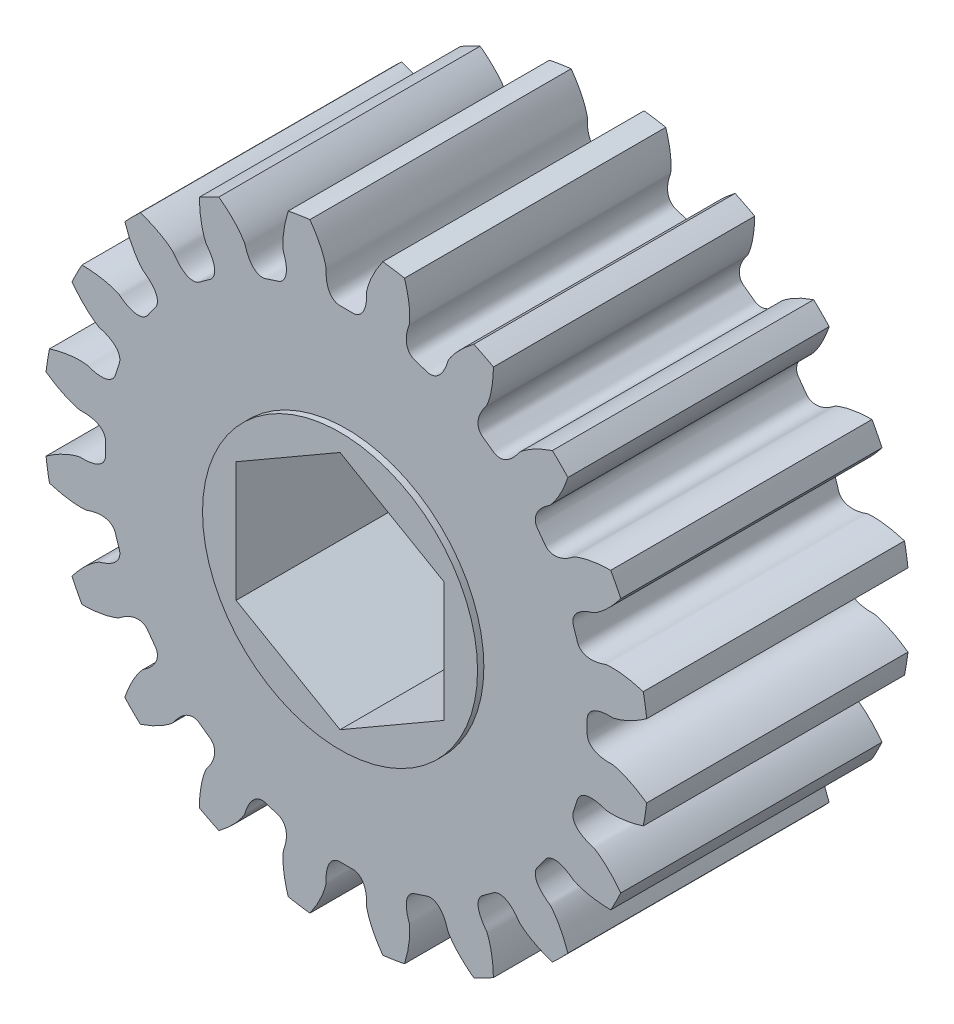
from build123d import *

# Parameters (mm, degrees)
BOSS_EXTRUDE1_DEPTH = 12.065
SKETCH2_R           = 6.35
BOSS_EXTRUDE2_DEPTH = 0.2921
BOSS_EXTRUDE3_START = 0.2921
SKETCH3_R           = 6.35
BOSS_EXTRUDE3_DEPTH = 0.2921
CUT_EXTRUDE1_DEPTH  = 24.338021171


with BuildPart() as part:
    # Sketch1 → Boss-Extrude1 (new body)
    with BuildSketch(Plane.XY.offset(6.0325)):
        with BuildLine():
            ThreePointArc((10.230831217, 9.512675365), (9.878281733, 9.878281733), (9.512675365, 10.230831217))
            add(Edge.make_bspline(
                [(6.790520347, 12.208592606), (6.789049814, 12.095329691), (6.782686734, 11.929946947), (6.765537407, 11.715987182), (6.749788038, 11.569261116), (6.731285472, 11.431876081), (6.710521074, 11.303867458), (6.687985966, 11.185250935), (6.664170625, 11.076022333), (6.639562645, 10.976158721), (6.614651246, 10.88561498), (6.589909593, 10.80433542), (6.565848579, 10.732217032), (6.542844439, 10.669225937), (6.52166786, 10.615038746), (6.495929693, 10.556574971), (6.470161531, 10.491487475), (6.424615713, 10.441415192), (6.393943037, 10.398531232), (6.369378589, 10.36439806), (6.346004023, 10.330387779), (6.323585507, 10.296648729), (6.302173447, 10.263144513), (6.281744386, 10.22988487), (6.262294419, 10.196865285), (6.243814996, 10.164082457), (6.226299407, 10.131529962), (6.20974131, 10.099199033), (6.194135393, 10.067077965), (6.179477546, 10.035151824), (6.165765255, 10.003402014), (6.152998041, 9.971805829), (6.141178039, 9.940335941), (6.130310714, 9.908959842), (6.120405769, 9.877639252), (6.111478297, 9.846329499), (6.103550219, 9.814978912), (6.09665211, 9.783528272), (6.090825461, 9.751910419), (6.086125512, 9.720050139), (6.082624709, 9.687864549), (6.080416885, 9.65526428), (6.079622164, 9.622155894), (6.080392488, 9.588446155), (6.082917433, 9.55404892), (6.087429592, 9.518895632), (6.094208228, 9.482950389), (6.103579075, 9.446230348), (6.115907232, 9.408831405), (6.131579299, 9.370957427), (6.150971147, 9.332948442), (6.174398879, 9.295300488), (6.202057943, 9.258663835), (6.233951347, 9.223818856), (6.267277867, 9.193902709), (6.36845856, 9.118313202), (6.541847615, 9.004080784), (6.704069266, 8.874477752), (6.807225712, 8.801607637), (6.84597612, 8.779156831), (6.888971268, 8.759592091), (6.932361917, 8.744608106), (6.975406816, 8.733960867), (7.017547919, 8.727263546), (7.058411147, 8.724062227), (7.097789266, 8.723894363), (7.135607851, 8.726329274), (7.171888523, 8.730990099), (7.20671562, 8.737561744), (7.240209585, 8.745789709), (7.272507496, 8.75547397), (7.303749859, 8.766460848), (7.334072303, 8.778634651), (7.36360081, 8.791910006), (7.392449373, 8.806225291), (7.420719205, 8.821537217), (7.448498908, 8.837816492), (7.475865178, 8.855044406), (7.502883781, 8.873210182), (7.529610636, 8.892308939), (7.556092891, 8.912340127), (7.582369952, 8.933306348), (7.608474423, 8.955212448), (7.634432956, 8.978064842), (7.660266997, 9.001871003), (7.685993454, 9.026639068), (7.711625261, 9.052377561), (7.73717191, 9.07909515), (7.762639776, 9.106800577), (7.788032897, 9.135502207), (7.81335177, 9.165209194), (7.838599483, 9.195926645), (7.863759524, 9.227673861), (7.888882085, 9.260414148), (7.913753829, 9.294324057), (7.945060521, 9.336747378), (7.97860766, 9.395537212), (8.032546746, 9.440157332), (8.08019557, 9.482702084), (8.125186728, 9.51958697), (8.177986149, 9.560930527), (8.23913955, 9.606099718), (8.308795414, 9.654747193), (8.387209583, 9.706418897), (8.474581238, 9.76068203), (8.571104467, 9.817085259), (8.676951752, 9.875171942), (8.792278635, 9.934476897), (8.917221961, 9.994528194), (9.05189992, 10.054847583), (9.250088315, 10.137274765), (9.405410351, 10.194432492), (9.512675365, 10.230831217)],
                knots=[0, 0, 0, 0, 0.047933382, 0.070007965, 0.090821144, 0.110372918, 0.128663287, 0.145692252, 0.161459812, 0.175965967, 0.189210717, 0.201194063, 0.211916004, 0.22137654, 0.229575672, 0.236513398, 0.248465852, 0.258824021, 0.264865189, 0.270795102, 0.276615554, 0.282328511, 0.287936135, 0.293440809, 0.29884516, 0.304152096, 0.30936484, 0.31448697, 0.319522469, 0.324475781, 0.329351871, 0.334156301, 0.33889531, 0.343575914, 0.348206011, 0.352794505, 0.357351445, 0.361888172, 0.366417487, 0.370953817, 0.375513382, 0.380114337, 0.384776871, 0.389523214, 0.394377492, 0.399365346, 0.404513199, 0.409847051, 0.415390659, 0.421163028, 0.427175267, 0.433427087, 0.439903549, 0.446572967, 0.453386989, 0.458818602, 0.5, 0.541181398, 0.546613011, 0.553427033, 0.560096451, 0.566572913, 0.572824733, 0.578836972, 0.584609341, 0.590152949, 0.595486801, 0.600634654, 0.605622508, 0.610476786, 0.615223129, 0.619885663, 0.624486618, 0.629046183, 0.633582513, 0.638111828, 0.642648555, 0.647205495, 0.651793989, 0.656424086, 0.66110469, 0.665843699, 0.670648129, 0.675524219, 0.680477531, 0.68551303, 0.69063516, 0.695847904, 0.70115484, 0.706559191, 0.712063865, 0.717671489, 0.723384446, 0.729204898, 0.735134811, 0.741175979, 0.751534148, 0.763486602, 0.770424328, 0.77862346, 0.788083996, 0.798805937, 0.810789283, 0.824034033, 0.838540188, 0.854307748, 0.871336713, 0.889627082, 0.909178856, 0.929992035, 0.952066618, 1, 1, 1, 1], degree=3))
            ThreePointArc((6.790520347, 12.208592606), (6.342247281, 12.447361143), (5.88559118, 12.669677046))
            add(Edge.make_bspline(
                [(2.685506032, 13.709447741), (2.719107638, 13.601273887), (2.764162068, 13.442019252), (2.813969292, 13.233231989), (2.844331599, 13.088820385), (2.869188924, 12.952441845), (2.888997649, 12.824281858), (2.904220008, 12.70450711), (2.915323768, 12.593265191), (2.922779741, 12.490684968), (2.927067147, 12.396874707), (2.928653202, 12.311927661), (2.928055626, 12.235903736), (2.925642708, 12.168886974), (2.922247347, 12.110807971), (2.915835196, 12.047252085), (2.911441359, 11.977387399), (2.883597899, 11.915691396), (2.867678323, 11.865427948), (2.854863874, 11.82537454), (2.843143096, 11.785805703), (2.83224776, 11.746790257), (2.822237054, 11.708309163), (2.813085657, 11.670364436), (2.804791252, 11.632950574), (2.797346727, 11.596061797), (2.790747687, 11.559689919), (2.784990807, 11.523824645), (2.780074653, 11.488453201), (2.775999933, 11.453560112), (2.77277, 11.419126917), (2.770391416, 11.385131874), (2.768874656, 11.35154965), (2.768234964, 11.318351018), (2.768493396, 11.285502571), (2.769678111, 11.252966486), (2.771825925, 11.220700396), (2.774984215, 11.188657426), (2.779213197, 11.156786527), (2.784588648, 11.125033236), (2.791205081, 11.093341114), (2.799179353, 11.06165416), (2.808654582, 11.029920632), (2.819804086, 10.998098808), (2.832834781, 10.966165345), (2.847989063, 10.934126915), (2.86554362, 10.902035671), (2.885802942, 10.870008588), (2.909084625, 10.838249689), (2.935693349, 10.807072331), (2.965881515, 10.776916049), (2.999796469, 10.748350284), (3.037423151, 10.722053877), (3.078523271, 10.698769937), (3.119463274, 10.680616451), (3.239050273, 10.639993112), (3.439252822, 10.584931791), (3.63358432, 10.511801229), (3.754210034, 10.474374727), (3.798001542, 10.464997275), (3.844938195, 10.459676334), (3.89083546, 10.458834165), (3.93506377, 10.462009645), (3.977211927, 10.46866243), (4.017064428, 10.478245228), (4.054567118, 10.490254087), (4.0897823, 10.504256411), (4.122846996, 10.519900463), (4.153938783, 10.536912634), (4.183250856, 10.555088098), (4.210975393, 10.57427898), (4.237293514, 10.594382544), (4.26236996, 10.615330668), (4.286350929, 10.637081092), (4.309363876, 10.659610434), (4.331518439, 10.682908799), (4.352907934, 10.70697571), (4.373611085, 10.731817072), (4.39369377, 10.757442959), (4.413210679, 10.783866009), (4.432206823, 10.811100268), (4.450718874, 10.839160387), (4.468776345, 10.868061051), (4.486402598, 10.897816598), (4.503615723, 10.92844076), (4.520429284, 10.959946502), (4.53685295, 10.992345927), (4.552893067, 11.025650213), (4.568553, 11.059869643), (4.583834001, 11.095013422), (4.598733717, 11.131090407), (4.613253505, 11.168106411), (4.627371696, 11.206074688), (4.641147366, 11.24497585), (4.654323063, 11.284911882), (4.670987968, 11.334933157), (4.684726136, 11.401212248), (4.72223688, 11.460316599), (4.754406553, 11.515503358), (4.78579763, 11.564486002), (4.823237002, 11.620121979), (4.867439295, 11.681977873), (4.918653062, 11.749769217), (4.977261934, 11.823143238), (5.043589085, 11.901749871), (5.117958575, 11.985219847), (5.200675553, 12.073172176), (5.292031698, 12.165212507), (5.392302991, 12.260934295), (5.501749624, 12.35991922), (5.664766589, 12.499555712), (5.794823915, 12.601913089), (5.88559118, 12.669677046)],
                knots=[0, 0, 0, 0, 0.047933382, 0.070007965, 0.090821144, 0.110372918, 0.128663287, 0.145692252, 0.161459812, 0.175965967, 0.189210717, 0.201194063, 0.211916004, 0.22137654, 0.229575672, 0.236513398, 0.248465852, 0.258824021, 0.264865189, 0.270795102, 0.276615554, 0.282328511, 0.287936135, 0.293440809, 0.29884516, 0.304152096, 0.30936484, 0.31448697, 0.319522469, 0.324475781, 0.329351871, 0.334156301, 0.33889531, 0.343575914, 0.348206011, 0.352794505, 0.357351445, 0.361888172, 0.366417487, 0.370953817, 0.375513382, 0.380114337, 0.384776871, 0.389523214, 0.394377492, 0.399365346, 0.404513199, 0.409847051, 0.415390659, 0.421163028, 0.427175267, 0.433427087, 0.439903549, 0.446572967, 0.453386989, 0.458818602, 0.5, 0.541181398, 0.546613011, 0.553427033, 0.560096451, 0.566572913, 0.572824733, 0.578836972, 0.584609341, 0.590152949, 0.595486801, 0.600634654, 0.605622508, 0.610476786, 0.615223129, 0.619885663, 0.624486618, 0.629046183, 0.633582513, 0.638111828, 0.642648555, 0.647205495, 0.651793989, 0.656424086, 0.66110469, 0.665843699, 0.670648129, 0.675524219, 0.680477531, 0.68551303, 0.69063516, 0.695847904, 0.70115484, 0.706559191, 0.712063865, 0.717671489, 0.723384446, 0.729204898, 0.735134811, 0.741175979, 0.751534148, 0.763486602, 0.770424328, 0.77862346, 0.788083996, 0.798805937, 0.810789283, 0.824034033, 0.838540188, 0.854307748, 0.871336713, 0.889627082, 0.909178856, 0.929992035, 0.952066618, 1, 1, 1, 1], degree=3))
            ThreePointArc((2.685506032, 13.709447741), (2.185389477, 13.798006118), (1.682384324, 13.868326611))
            add(Edge.make_bspline(
                [(-1.682384324, 13.868326611), (-1.616999739, 13.77583063), (-1.524938041, 13.638293056), (-1.413049743, 13.455115848), (-1.339547833, 13.32715472), (-1.273763826, 13.205132356), (-1.215320995, 13.089366198), (-1.163831239, 12.980157611), (-1.118895292, 12.87779151), (-1.080105208, 12.782535943), (-1.047038678, 12.694641964), (-1.019280169, 12.61434264), (-0.996355812, 12.54185493), (-0.977941316, 12.477372569), (-0.963223097, 12.42108693), (-0.949681567, 12.358660227), (-0.932270978, 12.290857192), (-0.939686569, 12.223576704), (-0.939294726, 12.170853905), (-0.939104807, 12.128800968), (-0.938024486, 12.087546848), (-0.936330131, 12.047074109), (-0.933959566, 12.007382936), (-0.930937496, 11.968467419), (-0.927264425, 11.93032161), (-0.92294533, 11.892937813), (-0.917981862, 11.856306886), (-0.912374001, 11.82041801), (-0.906119163, 11.785258592), (-0.899211895, 11.750814135), (-0.891643302, 11.717068117), (-0.883400423, 11.684001886), (-0.87446547, 11.651594589), (-0.864814912, 11.619823138), (-0.8544184, 11.588662268), (-0.843237466, 11.55808471), (-0.831224003, 11.528061545), (-0.818318468, 11.498562836), (-0.804447818, 11.469558637), (-0.789523154, 11.441020568), (-0.773437148, 11.412924159), (-0.756061357, 11.38525226), (-0.73724368, 11.357999889), (-0.716806387, 11.331180922), (-0.694545476, 11.304837099), (-0.670232479, 11.279049673), (-0.643620363, 11.253953742), (-0.61445569, 11.229754651), (-0.582499454, 11.206744579), (-0.547558721, 11.185315697), (-0.509529265, 11.165964025), (-0.46844692, 11.149276665), (-0.424535782, 11.13589458), (-0.378252112, 11.126450873), (-0.33370612, 11.121837039), (-0.207418823, 11.120156362), (0, 11.129655924), (0.207418823, 11.120156362), (0.33370612, 11.121837039), (0.378252112, 11.126450873), (0.424535782, 11.13589458), (0.46844692, 11.149276665), (0.509529265, 11.165964025), (0.547558721, 11.185315697), (0.582499454, 11.206744579), (0.61445569, 11.229754651), (0.643620363, 11.253953742), (0.670232479, 11.279049673), (0.694545476, 11.304837099), (0.716806387, 11.331180922), (0.73724368, 11.357999889), (0.756061357, 11.38525226), (0.773437148, 11.412924159), (0.789523154, 11.441020568), (0.804447818, 11.469558637), (0.818318468, 11.498562836), (0.831224003, 11.528061545), (0.843237466, 11.55808471), (0.8544184, 11.588662268), (0.864814912, 11.619823138), (0.87446547, 11.651594589), (0.883400423, 11.684001886), (0.891643302, 11.717068117), (0.899211895, 11.750814135), (0.906119163, 11.785258592), (0.912374001, 11.82041801), (0.917981862, 11.856306886), (0.92294533, 11.892937813), (0.927264425, 11.93032161), (0.930937496, 11.968467419), (0.933959566, 12.007382936), (0.936330131, 12.047074109), (0.938024486, 12.087546848), (0.939104807, 12.128800968), (0.939294726, 12.170853905), (0.939686569, 12.223576704), (0.932270978, 12.290857192), (0.949681567, 12.358660227), (0.963223097, 12.42108693), (0.977941316, 12.477372569), (0.996355812, 12.54185493), (1.019280169, 12.61434264), (1.047038678, 12.694641964), (1.080105208, 12.782535943), (1.118895292, 12.87779151), (1.163831239, 12.980157611), (1.215320995, 13.089366198), (1.273763826, 13.205132356), (1.339547833, 13.32715472), (1.413049743, 13.455115848), (1.524938041, 13.638293056), (1.616999739, 13.77583063), (1.682384324, 13.868326611)],
                knots=[0, 0, 0, 0, 0.047933382, 0.070007965, 0.090821144, 0.110372918, 0.128663287, 0.145692252, 0.161459812, 0.175965967, 0.189210717, 0.201194063, 0.211916004, 0.22137654, 0.229575672, 0.236513398, 0.248465852, 0.258824021, 0.264865189, 0.270795102, 0.276615554, 0.282328511, 0.287936135, 0.293440809, 0.29884516, 0.304152096, 0.30936484, 0.31448697, 0.319522469, 0.324475781, 0.329351871, 0.334156301, 0.33889531, 0.343575914, 0.348206011, 0.352794505, 0.357351445, 0.361888172, 0.366417487, 0.370953817, 0.375513382, 0.380114337, 0.384776871, 0.389523214, 0.394377492, 0.399365346, 0.404513199, 0.409847051, 0.415390659, 0.421163028, 0.427175267, 0.433427087, 0.439903549, 0.446572967, 0.453386989, 0.458818602, 0.5, 0.541181398, 0.546613011, 0.553427033, 0.560096451, 0.566572913, 0.572824733, 0.578836972, 0.584609341, 0.590152949, 0.595486801, 0.600634654, 0.605622508, 0.610476786, 0.615223129, 0.619885663, 0.624486618, 0.629046183, 0.633582513, 0.638111828, 0.642648555, 0.647205495, 0.651793989, 0.656424086, 0.66110469, 0.665843699, 0.670648129, 0.675524219, 0.680477531, 0.68551303, 0.69063516, 0.695847904, 0.70115484, 0.706559191, 0.712063865, 0.717671489, 0.723384446, 0.729204898, 0.735134811, 0.741175979, 0.751534148, 0.763486602, 0.770424328, 0.77862346, 0.788083996, 0.798805937, 0.810789283, 0.824034033, 0.838540188, 0.854307748, 0.871336713, 0.889627082, 0.909178856, 0.929992035, 0.952066618, 1, 1, 1, 1], degree=3))
            ThreePointArc((-1.682384324, 13.868326611), (-2.185389477, 13.798006118), (-2.685506032, 13.709447741))
            add(Edge.make_bspline(
                [(-5.88559118, 12.669677046), (-5.794823915, 12.601913089), (-5.664766589, 12.499555712), (-5.501749624, 12.35991922), (-5.392302991, 12.260934295), (-5.292031698, 12.165212507), (-5.200675553, 12.073172176), (-5.117958575, 11.985219847), (-5.043589085, 11.901749871), (-4.977261934, 11.823143238), (-4.918653062, 11.749769217), (-4.867439295, 11.681977873), (-4.823237002, 11.620121979), (-4.78579763, 11.564486002), (-4.754406553, 11.515503358), (-4.72223688, 11.460316599), (-4.684726136, 11.401212248), (-4.670987968, 11.334933157), (-4.654323063, 11.284911882), (-4.641147366, 11.24497585), (-4.627371696, 11.206074688), (-4.613253505, 11.168106411), (-4.598733717, 11.131090407), (-4.583834001, 11.095013422), (-4.568553, 11.059869643), (-4.552893067, 11.025650213), (-4.53685295, 10.992345927), (-4.520429284, 10.959946502), (-4.503615723, 10.92844076), (-4.486402598, 10.897816598), (-4.468776345, 10.868061051), (-4.450718874, 10.839160387), (-4.432206823, 10.811100268), (-4.413210679, 10.783866009), (-4.39369377, 10.757442959), (-4.373611085, 10.731817072), (-4.352907934, 10.70697571), (-4.331518439, 10.682908799), (-4.309363876, 10.659610434), (-4.286350929, 10.637081092), (-4.26236996, 10.615330668), (-4.237293514, 10.594382544), (-4.210975393, 10.57427898), (-4.183250856, 10.555088098), (-4.153938783, 10.536912634), (-4.122846996, 10.519900463), (-4.0897823, 10.504256411), (-4.054567118, 10.490254087), (-4.017064428, 10.478245228), (-3.977211927, 10.46866243), (-3.93506377, 10.462009645), (-3.89083546, 10.458834165), (-3.844938195, 10.459676334), (-3.798001542, 10.464997275), (-3.754210034, 10.474374727), (-3.63358432, 10.511801229), (-3.439252822, 10.584931791), (-3.239050273, 10.639993112), (-3.119463274, 10.680616451), (-3.078523271, 10.698769937), (-3.037423151, 10.722053877), (-2.999796469, 10.748350284), (-2.965881515, 10.776916049), (-2.935693349, 10.807072331), (-2.909084625, 10.838249689), (-2.885802942, 10.870008588), (-2.86554362, 10.902035671), (-2.847989063, 10.934126915), (-2.832834781, 10.966165345), (-2.819804086, 10.998098808), (-2.808654582, 11.029920632), (-2.799179353, 11.06165416), (-2.791205081, 11.093341114), (-2.784588648, 11.125033236), (-2.779213197, 11.156786527), (-2.774984215, 11.188657426), (-2.771825925, 11.220700396), (-2.769678111, 11.252966486), (-2.768493396, 11.285502571), (-2.768234964, 11.318351018), (-2.768874656, 11.35154965), (-2.770391416, 11.385131874), (-2.77277, 11.419126917), (-2.775999933, 11.453560112), (-2.780074653, 11.488453201), (-2.784990807, 11.523824645), (-2.790747687, 11.559689919), (-2.797346727, 11.596061797), (-2.804791252, 11.632950574), (-2.813085657, 11.670364436), (-2.822237054, 11.708309163), (-2.83224776, 11.746790257), (-2.843143096, 11.785805703), (-2.854863874, 11.82537454), (-2.867678323, 11.865427948), (-2.883597899, 11.915691396), (-2.911441359, 11.977387399), (-2.915835196, 12.047252085), (-2.922247347, 12.110807971), (-2.925642708, 12.168886974), (-2.928055626, 12.235903736), (-2.928653202, 12.311927661), (-2.927067147, 12.396874707), (-2.922779741, 12.490684968), (-2.915323768, 12.593265191), (-2.904220008, 12.70450711), (-2.888997649, 12.824281858), (-2.869188924, 12.952441845), (-2.844331599, 13.088820385), (-2.813969292, 13.233231989), (-2.764162068, 13.442019252), (-2.719107638, 13.601273887), (-2.685506032, 13.709447741)],
                knots=[0, 0, 0, 0, 0.047933382, 0.070007965, 0.090821144, 0.110372918, 0.128663287, 0.145692252, 0.161459812, 0.175965967, 0.189210717, 0.201194063, 0.211916004, 0.22137654, 0.229575672, 0.236513398, 0.248465852, 0.258824021, 0.264865189, 0.270795102, 0.276615554, 0.282328511, 0.287936135, 0.293440809, 0.29884516, 0.304152096, 0.30936484, 0.31448697, 0.319522469, 0.324475781, 0.329351871, 0.334156301, 0.33889531, 0.343575914, 0.348206011, 0.352794505, 0.357351445, 0.361888172, 0.366417487, 0.370953817, 0.375513382, 0.380114337, 0.384776871, 0.389523214, 0.394377492, 0.399365346, 0.404513199, 0.409847051, 0.415390659, 0.421163028, 0.427175267, 0.433427087, 0.439903549, 0.446572967, 0.453386989, 0.458818602, 0.5, 0.541181398, 0.546613011, 0.553427033, 0.560096451, 0.566572913, 0.572824733, 0.578836972, 0.584609341, 0.590152949, 0.595486801, 0.600634654, 0.605622508, 0.610476786, 0.615223129, 0.619885663, 0.624486618, 0.629046183, 0.633582513, 0.638111828, 0.642648555, 0.647205495, 0.651793989, 0.656424086, 0.66110469, 0.665843699, 0.670648129, 0.675524219, 0.680477531, 0.68551303, 0.69063516, 0.695847904, 0.70115484, 0.706559191, 0.712063865, 0.717671489, 0.723384446, 0.729204898, 0.735134811, 0.741175979, 0.751534148, 0.763486602, 0.770424328, 0.77862346, 0.788083996, 0.798805937, 0.810789283, 0.824034033, 0.838540188, 0.854307748, 0.871336713, 0.889627082, 0.909178856, 0.929992035, 0.952066618, 1, 1, 1, 1], degree=3))
            ThreePointArc((-5.88559118, 12.669677046), (-6.342247281, 12.447361143), (-6.790520347, 12.208592606))
            add(Edge.make_bspline(
                [(-9.512675365, 10.230831217), (-9.405410351, 10.194432492), (-9.250088315, 10.137274765), (-9.05189992, 10.054847583), (-8.917221961, 9.994528194), (-8.792278635, 9.934476897), (-8.676951752, 9.875171942), (-8.571104467, 9.817085259), (-8.474581238, 9.76068203), (-8.387209583, 9.706418897), (-8.308795414, 9.654747193), (-8.23913955, 9.606099718), (-8.177986149, 9.560930527), (-8.125186728, 9.51958697), (-8.08019557, 9.482702084), (-8.032546746, 9.440157332), (-7.97860766, 9.395537212), (-7.945060521, 9.336747378), (-7.913753829, 9.294324057), (-7.888882085, 9.260414148), (-7.863759524, 9.227673861), (-7.838599483, 9.195926645), (-7.81335177, 9.165209194), (-7.788032897, 9.135502207), (-7.762639776, 9.106800577), (-7.73717191, 9.07909515), (-7.711625261, 9.052377561), (-7.685993454, 9.026639068), (-7.660266997, 9.001871003), (-7.634432956, 8.978064842), (-7.608474423, 8.955212448), (-7.582369952, 8.933306348), (-7.556092891, 8.912340127), (-7.529610636, 8.892308939), (-7.502883781, 8.873210182), (-7.475865178, 8.855044406), (-7.448498908, 8.837816492), (-7.420719205, 8.821537217), (-7.392449373, 8.806225291), (-7.36360081, 8.791910006), (-7.334072303, 8.778634651), (-7.303749859, 8.766460848), (-7.272507496, 8.75547397), (-7.240209585, 8.745789709), (-7.20671562, 8.737561744), (-7.171888523, 8.730990099), (-7.135607851, 8.726329274), (-7.097789266, 8.723894363), (-7.058411147, 8.724062227), (-7.017547919, 8.727263546), (-6.975406816, 8.733960867), (-6.932361917, 8.744608106), (-6.888971268, 8.759592091), (-6.84597612, 8.779156831), (-6.807225712, 8.801607637), (-6.704069266, 8.874477752), (-6.541847615, 9.004080784), (-6.36845856, 9.118313202), (-6.267277867, 9.193902709), (-6.233951347, 9.223818856), (-6.202057943, 9.258663835), (-6.174398879, 9.295300488), (-6.150971147, 9.332948442), (-6.131579299, 9.370957427), (-6.115907232, 9.408831405), (-6.103579075, 9.446230348), (-6.094208228, 9.482950389), (-6.087429592, 9.518895632), (-6.082917433, 9.55404892), (-6.080392488, 9.588446155), (-6.079622164, 9.622155894), (-6.080416885, 9.65526428), (-6.082624709, 9.687864549), (-6.086125512, 9.720050139), (-6.090825461, 9.751910419), (-6.09665211, 9.783528272), (-6.103550219, 9.814978912), (-6.111478297, 9.846329499), (-6.120405769, 9.877639252), (-6.130310714, 9.908959842), (-6.141178039, 9.940335941), (-6.152998041, 9.971805829), (-6.165765255, 10.003402014), (-6.179477546, 10.035151824), (-6.194135393, 10.067077965), (-6.20974131, 10.099199033), (-6.226299407, 10.131529962), (-6.243814996, 10.164082457), (-6.262294419, 10.196865285), (-6.281744386, 10.22988487), (-6.302173447, 10.263144513), (-6.323585507, 10.296648729), (-6.346004023, 10.330387779), (-6.369378589, 10.36439806), (-6.393943037, 10.398531232), (-6.424615713, 10.441415192), (-6.470161531, 10.491487475), (-6.495929693, 10.556574971), (-6.52166786, 10.615038746), (-6.542844439, 10.669225937), (-6.565848579, 10.732217032), (-6.589909593, 10.80433542), (-6.614651246, 10.88561498), (-6.639562645, 10.976158721), (-6.664170625, 11.076022333), (-6.687985966, 11.185250935), (-6.710521074, 11.303867458), (-6.731285472, 11.431876081), (-6.749788038, 11.569261116), (-6.765537407, 11.715987182), (-6.782686734, 11.929946947), (-6.789049814, 12.095329691), (-6.790520347, 12.208592606)],
                knots=[0, 0, 0, 0, 0.047933382, 0.070007965, 0.090821144, 0.110372918, 0.128663287, 0.145692252, 0.161459812, 0.175965967, 0.189210717, 0.201194063, 0.211916004, 0.22137654, 0.229575672, 0.236513398, 0.248465852, 0.258824021, 0.264865189, 0.270795102, 0.276615554, 0.282328511, 0.287936135, 0.293440809, 0.29884516, 0.304152096, 0.30936484, 0.31448697, 0.319522469, 0.324475781, 0.329351871, 0.334156301, 0.33889531, 0.343575914, 0.348206011, 0.352794505, 0.357351445, 0.361888172, 0.366417487, 0.370953817, 0.375513382, 0.380114337, 0.384776871, 0.389523214, 0.394377492, 0.399365346, 0.404513199, 0.409847051, 0.415390659, 0.421163028, 0.427175267, 0.433427087, 0.439903549, 0.446572967, 0.453386989, 0.458818602, 0.5, 0.541181398, 0.546613011, 0.553427033, 0.560096451, 0.566572913, 0.572824733, 0.578836972, 0.584609341, 0.590152949, 0.595486801, 0.600634654, 0.605622508, 0.610476786, 0.615223129, 0.619885663, 0.624486618, 0.629046183, 0.633582513, 0.638111828, 0.642648555, 0.647205495, 0.651793989, 0.656424086, 0.66110469, 0.665843699, 0.670648129, 0.675524219, 0.680477531, 0.68551303, 0.69063516, 0.695847904, 0.70115484, 0.706559191, 0.712063865, 0.717671489, 0.723384446, 0.729204898, 0.735134811, 0.741175979, 0.751534148, 0.763486602, 0.770424328, 0.77862346, 0.788083996, 0.798805937, 0.810789283, 0.824034033, 0.838540188, 0.854307748, 0.871336713, 0.889627082, 0.909178856, 0.929992035, 0.952066618, 1, 1, 1, 1], degree=3))
            ThreePointArc((-9.512675365, 10.230831217), (-9.878281733, 9.878281733), (-10.230831217, 9.512675365))
            add(Edge.make_bspline(
                [(-12.208592606, 6.790520347), (-12.095329691, 6.789049814), (-11.929946947, 6.782686734), (-11.715987182, 6.765537407), (-11.569261116, 6.749788038), (-11.431876081, 6.731285472), (-11.303867458, 6.710521074), (-11.185250935, 6.687985966), (-11.076022333, 6.664170625), (-10.976158721, 6.639562645), (-10.88561498, 6.614651246), (-10.80433542, 6.589909593), (-10.732217032, 6.565848579), (-10.669225937, 6.542844439), (-10.615038746, 6.52166786), (-10.556574971, 6.495929693), (-10.491487475, 6.470161531), (-10.441415192, 6.424615713), (-10.398531232, 6.393943037), (-10.36439806, 6.369378589), (-10.330387779, 6.346004023), (-10.296648729, 6.323585507), (-10.263144513, 6.302173447), (-10.22988487, 6.281744386), (-10.196865285, 6.262294419), (-10.164082457, 6.243814996), (-10.131529962, 6.226299407), (-10.099199033, 6.20974131), (-10.067077965, 6.194135393), (-10.035151824, 6.179477546), (-10.003402014, 6.165765255), (-9.971805829, 6.152998041), (-9.940335941, 6.141178039), (-9.908959842, 6.130310714), (-9.877639252, 6.120405769), (-9.846329499, 6.111478297), (-9.814978912, 6.103550219), (-9.783528272, 6.09665211), (-9.751910419, 6.090825461), (-9.720050139, 6.086125512), (-9.687864549, 6.082624709), (-9.65526428, 6.080416885), (-9.622155894, 6.079622164), (-9.588446155, 6.080392488), (-9.55404892, 6.082917433), (-9.518895632, 6.087429592), (-9.482950389, 6.094208228), (-9.446230348, 6.103579075), (-9.408831405, 6.115907232), (-9.370957427, 6.131579299), (-9.332948442, 6.150971147), (-9.295300488, 6.174398879), (-9.258663835, 6.202057943), (-9.223818856, 6.233951347), (-9.193902709, 6.267277867), (-9.118313202, 6.36845856), (-9.004080784, 6.541847615), (-8.874477752, 6.704069266), (-8.801607637, 6.807225712), (-8.779156831, 6.84597612), (-8.759592091, 6.888971268), (-8.744608106, 6.932361917), (-8.733960867, 6.975406816), (-8.727263546, 7.017547919), (-8.724062227, 7.058411147), (-8.723894363, 7.097789266), (-8.726329274, 7.135607851), (-8.730990099, 7.171888523), (-8.737561744, 7.20671562), (-8.745789709, 7.240209585), (-8.75547397, 7.272507496), (-8.766460848, 7.303749859), (-8.778634651, 7.334072303), (-8.791910006, 7.36360081), (-8.806225291, 7.392449373), (-8.821537217, 7.420719205), (-8.837816492, 7.448498908), (-8.855044406, 7.475865178), (-8.873210182, 7.502883781), (-8.892308939, 7.529610636), (-8.912340127, 7.556092891), (-8.933306348, 7.582369952), (-8.955212448, 7.608474423), (-8.978064842, 7.634432956), (-9.001871003, 7.660266997), (-9.026639068, 7.685993454), (-9.052377561, 7.711625261), (-9.07909515, 7.73717191), (-9.106800577, 7.762639776), (-9.135502207, 7.788032897), (-9.165209194, 7.81335177), (-9.195926645, 7.838599483), (-9.227673861, 7.863759524), (-9.260414148, 7.888882085), (-9.294324057, 7.913753829), (-9.336747378, 7.945060521), (-9.395537212, 7.97860766), (-9.440157332, 8.032546746), (-9.482702084, 8.08019557), (-9.51958697, 8.125186728), (-9.560930527, 8.177986149), (-9.606099718, 8.23913955), (-9.654747193, 8.308795414), (-9.706418897, 8.387209583), (-9.76068203, 8.474581238), (-9.817085259, 8.571104467), (-9.875171942, 8.676951752), (-9.934476897, 8.792278635), (-9.994528194, 8.917221961), (-10.054847583, 9.05189992), (-10.137274765, 9.250088315), (-10.194432492, 9.405410351), (-10.230831217, 9.512675365)],
                knots=[0, 0, 0, 0, 0.047933382, 0.070007965, 0.090821144, 0.110372918, 0.128663287, 0.145692252, 0.161459812, 0.175965967, 0.189210717, 0.201194063, 0.211916004, 0.22137654, 0.229575672, 0.236513398, 0.248465852, 0.258824021, 0.264865189, 0.270795102, 0.276615554, 0.282328511, 0.287936135, 0.293440809, 0.29884516, 0.304152096, 0.30936484, 0.31448697, 0.319522469, 0.324475781, 0.329351871, 0.334156301, 0.33889531, 0.343575914, 0.348206011, 0.352794505, 0.357351445, 0.361888172, 0.366417487, 0.370953817, 0.375513382, 0.380114337, 0.384776871, 0.389523214, 0.394377492, 0.399365346, 0.404513199, 0.409847051, 0.415390659, 0.421163028, 0.427175267, 0.433427087, 0.439903549, 0.446572967, 0.453386989, 0.458818602, 0.5, 0.541181398, 0.546613011, 0.553427033, 0.560096451, 0.566572913, 0.572824733, 0.578836972, 0.584609341, 0.590152949, 0.595486801, 0.600634654, 0.605622508, 0.610476786, 0.615223129, 0.619885663, 0.624486618, 0.629046183, 0.633582513, 0.638111828, 0.642648555, 0.647205495, 0.651793989, 0.656424086, 0.66110469, 0.665843699, 0.670648129, 0.675524219, 0.680477531, 0.68551303, 0.69063516, 0.695847904, 0.70115484, 0.706559191, 0.712063865, 0.717671489, 0.723384446, 0.729204898, 0.735134811, 0.741175979, 0.751534148, 0.763486602, 0.770424328, 0.77862346, 0.788083996, 0.798805937, 0.810789283, 0.824034033, 0.838540188, 0.854307748, 0.871336713, 0.889627082, 0.909178856, 0.929992035, 0.952066618, 1, 1, 1, 1], degree=3))
            ThreePointArc((-12.208592606, 6.790520347), (-12.447361143, 6.342247281), (-12.669677046, 5.88559118))
            add(Edge.make_bspline(
                [(-13.709447741, 2.685506032), (-13.601273887, 2.719107638), (-13.442019252, 2.764162068), (-13.233231989, 2.813969292), (-13.088820385, 2.844331599), (-12.952441845, 2.869188924), (-12.824281858, 2.888997649), (-12.70450711, 2.904220008), (-12.593265191, 2.915323768), (-12.490684968, 2.922779741), (-12.396874707, 2.927067147), (-12.311927661, 2.928653202), (-12.235903736, 2.928055626), (-12.168886974, 2.925642708), (-12.110807971, 2.922247347), (-12.047252085, 2.915835196), (-11.977387399, 2.911441359), (-11.915691396, 2.883597899), (-11.865427948, 2.867678323), (-11.82537454, 2.854863874), (-11.785805703, 2.843143096), (-11.746790257, 2.83224776), (-11.708309163, 2.822237054), (-11.670364436, 2.813085657), (-11.632950574, 2.804791252), (-11.596061797, 2.797346727), (-11.559689919, 2.790747687), (-11.523824645, 2.784990807), (-11.488453201, 2.780074653), (-11.453560112, 2.775999933), (-11.419126917, 2.77277), (-11.385131874, 2.770391416), (-11.35154965, 2.768874656), (-11.318351018, 2.768234964), (-11.285502571, 2.768493396), (-11.252966486, 2.769678111), (-11.220700396, 2.771825925), (-11.188657426, 2.774984215), (-11.156786527, 2.779213197), (-11.125033236, 2.784588648), (-11.093341114, 2.791205081), (-11.06165416, 2.799179353), (-11.029920632, 2.808654582), (-10.998098808, 2.819804086), (-10.966165345, 2.832834781), (-10.934126915, 2.847989063), (-10.902035671, 2.86554362), (-10.870008588, 2.885802942), (-10.838249689, 2.909084625), (-10.807072331, 2.935693349), (-10.776916049, 2.965881515), (-10.748350284, 2.999796469), (-10.722053877, 3.037423151), (-10.698769937, 3.078523271), (-10.680616451, 3.119463274), (-10.639993112, 3.239050273), (-10.584931791, 3.439252822), (-10.511801229, 3.63358432), (-10.474374727, 3.754210034), (-10.464997275, 3.798001542), (-10.459676334, 3.844938195), (-10.458834165, 3.89083546), (-10.462009645, 3.93506377), (-10.46866243, 3.977211927), (-10.478245228, 4.017064428), (-10.490254087, 4.054567118), (-10.504256411, 4.0897823), (-10.519900463, 4.122846996), (-10.536912634, 4.153938783), (-10.555088098, 4.183250856), (-10.57427898, 4.210975393), (-10.594382544, 4.237293514), (-10.615330668, 4.26236996), (-10.637081092, 4.286350929), (-10.659610434, 4.309363876), (-10.682908799, 4.331518439), (-10.70697571, 4.352907934), (-10.731817072, 4.373611085), (-10.757442959, 4.39369377), (-10.783866009, 4.413210679), (-10.811100268, 4.432206823), (-10.839160387, 4.450718874), (-10.868061051, 4.468776345), (-10.897816598, 4.486402598), (-10.92844076, 4.503615723), (-10.959946502, 4.520429284), (-10.992345927, 4.53685295), (-11.025650213, 4.552893067), (-11.059869643, 4.568553), (-11.095013422, 4.583834001), (-11.131090407, 4.598733717), (-11.168106411, 4.613253505), (-11.206074688, 4.627371696), (-11.24497585, 4.641147366), (-11.284911882, 4.654323063), (-11.334933157, 4.670987968), (-11.401212248, 4.684726136), (-11.460316599, 4.72223688), (-11.515503358, 4.754406553), (-11.564486002, 4.78579763), (-11.620121979, 4.823237002), (-11.681977873, 4.867439295), (-11.749769217, 4.918653062), (-11.823143238, 4.977261934), (-11.901749871, 5.043589085), (-11.985219847, 5.117958575), (-12.073172176, 5.200675553), (-12.165212507, 5.292031698), (-12.260934295, 5.392302991), (-12.35991922, 5.501749624), (-12.499555712, 5.664766589), (-12.601913089, 5.794823915), (-12.669677046, 5.88559118)],
                knots=[0, 0, 0, 0, 0.047933382, 0.070007965, 0.090821144, 0.110372918, 0.128663287, 0.145692252, 0.161459812, 0.175965967, 0.189210717, 0.201194063, 0.211916004, 0.22137654, 0.229575672, 0.236513398, 0.248465852, 0.258824021, 0.264865189, 0.270795102, 0.276615554, 0.282328511, 0.287936135, 0.293440809, 0.29884516, 0.304152096, 0.30936484, 0.31448697, 0.319522469, 0.324475781, 0.329351871, 0.334156301, 0.33889531, 0.343575914, 0.348206011, 0.352794505, 0.357351445, 0.361888172, 0.366417487, 0.370953817, 0.375513382, 0.380114337, 0.384776871, 0.389523214, 0.394377492, 0.399365346, 0.404513199, 0.409847051, 0.415390659, 0.421163028, 0.427175267, 0.433427087, 0.439903549, 0.446572967, 0.453386989, 0.458818602, 0.5, 0.541181398, 0.546613011, 0.553427033, 0.560096451, 0.566572913, 0.572824733, 0.578836972, 0.584609341, 0.590152949, 0.595486801, 0.600634654, 0.605622508, 0.610476786, 0.615223129, 0.619885663, 0.624486618, 0.629046183, 0.633582513, 0.638111828, 0.642648555, 0.647205495, 0.651793989, 0.656424086, 0.66110469, 0.665843699, 0.670648129, 0.675524219, 0.680477531, 0.68551303, 0.69063516, 0.695847904, 0.70115484, 0.706559191, 0.712063865, 0.717671489, 0.723384446, 0.729204898, 0.735134811, 0.741175979, 0.751534148, 0.763486602, 0.770424328, 0.77862346, 0.788083996, 0.798805937, 0.810789283, 0.824034033, 0.838540188, 0.854307748, 0.871336713, 0.889627082, 0.909178856, 0.929992035, 0.952066618, 1, 1, 1, 1], degree=3))
            ThreePointArc((-13.709447741, 2.685506032), (-13.798006118, 2.185389477), (-13.868326611, 1.682384324))
            add(Edge.make_bspline(
                [(-13.868326611, -1.682384324), (-13.77583063, -1.616999739), (-13.638293056, -1.524938041), (-13.455115848, -1.413049743), (-13.32715472, -1.339547833), (-13.205132356, -1.273763826), (-13.089366198, -1.215320995), (-12.980157611, -1.163831239), (-12.87779151, -1.118895292), (-12.782535943, -1.080105208), (-12.694641964, -1.047038678), (-12.61434264, -1.019280169), (-12.54185493, -0.996355812), (-12.477372569, -0.977941316), (-12.42108693, -0.963223097), (-12.358660227, -0.949681567), (-12.290857192, -0.932270978), (-12.223576704, -0.939686569), (-12.170853905, -0.939294726), (-12.128800968, -0.939104807), (-12.087546848, -0.938024486), (-12.047074109, -0.936330131), (-12.007382936, -0.933959566), (-11.968467419, -0.930937496), (-11.93032161, -0.927264425), (-11.892937813, -0.92294533), (-11.856306886, -0.917981862), (-11.82041801, -0.912374001), (-11.785258592, -0.906119163), (-11.750814135, -0.899211895), (-11.717068117, -0.891643302), (-11.684001886, -0.883400423), (-11.651594589, -0.87446547), (-11.619823138, -0.864814912), (-11.588662268, -0.8544184), (-11.55808471, -0.843237466), (-11.528061545, -0.831224003), (-11.498562836, -0.818318468), (-11.469558637, -0.804447818), (-11.441020568, -0.789523154), (-11.412924159, -0.773437148), (-11.38525226, -0.756061357), (-11.357999889, -0.73724368), (-11.331180922, -0.716806387), (-11.304837099, -0.694545476), (-11.279049673, -0.670232479), (-11.253953742, -0.643620363), (-11.229754651, -0.61445569), (-11.206744579, -0.582499454), (-11.185315697, -0.547558721), (-11.165964025, -0.509529265), (-11.149276665, -0.46844692), (-11.13589458, -0.424535782), (-11.126450873, -0.378252112), (-11.121837039, -0.33370612), (-11.120156362, -0.207418823), (-11.129655924, 0), (-11.120156362, 0.207418823), (-11.121837039, 0.33370612), (-11.126450873, 0.378252112), (-11.13589458, 0.424535782), (-11.149276665, 0.46844692), (-11.165964025, 0.509529265), (-11.185315697, 0.547558721), (-11.206744579, 0.582499454), (-11.229754651, 0.61445569), (-11.253953742, 0.643620363), (-11.279049673, 0.670232479), (-11.304837099, 0.694545476), (-11.331180922, 0.716806387), (-11.357999889, 0.73724368), (-11.38525226, 0.756061357), (-11.412924159, 0.773437148), (-11.441020568, 0.789523154), (-11.469558637, 0.804447818), (-11.498562836, 0.818318468), (-11.528061545, 0.831224003), (-11.55808471, 0.843237466), (-11.588662268, 0.8544184), (-11.619823138, 0.864814912), (-11.651594589, 0.87446547), (-11.684001886, 0.883400423), (-11.717068117, 0.891643302), (-11.750814135, 0.899211895), (-11.785258592, 0.906119163), (-11.82041801, 0.912374001), (-11.856306886, 0.917981862), (-11.892937813, 0.92294533), (-11.93032161, 0.927264425), (-11.968467419, 0.930937496), (-12.007382936, 0.933959566), (-12.047074109, 0.936330131), (-12.087546848, 0.938024486), (-12.128800968, 0.939104807), (-12.170853905, 0.939294726), (-12.223576704, 0.939686569), (-12.290857192, 0.932270978), (-12.358660227, 0.949681567), (-12.42108693, 0.963223097), (-12.477372569, 0.977941316), (-12.54185493, 0.996355812), (-12.61434264, 1.019280169), (-12.694641964, 1.047038678), (-12.782535943, 1.080105208), (-12.87779151, 1.118895292), (-12.980157611, 1.163831239), (-13.089366198, 1.215320995), (-13.205132356, 1.273763826), (-13.32715472, 1.339547833), (-13.455115848, 1.413049743), (-13.638293056, 1.524938041), (-13.77583063, 1.616999739), (-13.868326611, 1.682384324)],
                knots=[0, 0, 0, 0, 0.047933382, 0.070007965, 0.090821144, 0.110372918, 0.128663287, 0.145692252, 0.161459812, 0.175965967, 0.189210717, 0.201194063, 0.211916004, 0.22137654, 0.229575672, 0.236513398, 0.248465852, 0.258824021, 0.264865189, 0.270795102, 0.276615554, 0.282328511, 0.287936135, 0.293440809, 0.29884516, 0.304152096, 0.30936484, 0.31448697, 0.319522469, 0.324475781, 0.329351871, 0.334156301, 0.33889531, 0.343575914, 0.348206011, 0.352794505, 0.357351445, 0.361888172, 0.366417487, 0.370953817, 0.375513382, 0.380114337, 0.384776871, 0.389523214, 0.394377492, 0.399365346, 0.404513199, 0.409847051, 0.415390659, 0.421163028, 0.427175267, 0.433427087, 0.439903549, 0.446572967, 0.453386989, 0.458818602, 0.5, 0.541181398, 0.546613011, 0.553427033, 0.560096451, 0.566572913, 0.572824733, 0.578836972, 0.584609341, 0.590152949, 0.595486801, 0.600634654, 0.605622508, 0.610476786, 0.615223129, 0.619885663, 0.624486618, 0.629046183, 0.633582513, 0.638111828, 0.642648555, 0.647205495, 0.651793989, 0.656424086, 0.66110469, 0.665843699, 0.670648129, 0.675524219, 0.680477531, 0.68551303, 0.69063516, 0.695847904, 0.70115484, 0.706559191, 0.712063865, 0.717671489, 0.723384446, 0.729204898, 0.735134811, 0.741175979, 0.751534148, 0.763486602, 0.770424328, 0.77862346, 0.788083996, 0.798805937, 0.810789283, 0.824034033, 0.838540188, 0.854307748, 0.871336713, 0.889627082, 0.909178856, 0.929992035, 0.952066618, 1, 1, 1, 1], degree=3))
            ThreePointArc((-13.868326611, -1.682384324), (-13.798006118, -2.185389477), (-13.709447741, -2.685506032))
            add(Edge.make_bspline(
                [(-12.669677046, -5.88559118), (-12.601913089, -5.794823915), (-12.499555712, -5.664766589), (-12.35991922, -5.501749624), (-12.260934295, -5.392302991), (-12.165212507, -5.292031698), (-12.073172176, -5.200675553), (-11.985219847, -5.117958575), (-11.901749871, -5.043589085), (-11.823143238, -4.977261934), (-11.749769217, -4.918653062), (-11.681977873, -4.867439295), (-11.620121979, -4.823237002), (-11.564486002, -4.78579763), (-11.515503358, -4.754406553), (-11.460316599, -4.72223688), (-11.401212248, -4.684726136), (-11.334933157, -4.670987968), (-11.284911882, -4.654323063), (-11.24497585, -4.641147366), (-11.206074688, -4.627371696), (-11.168106411, -4.613253505), (-11.131090407, -4.598733717), (-11.095013422, -4.583834001), (-11.059869643, -4.568553), (-11.025650213, -4.552893067), (-10.992345927, -4.53685295), (-10.959946502, -4.520429284), (-10.92844076, -4.503615723), (-10.897816598, -4.486402598), (-10.868061051, -4.468776345), (-10.839160387, -4.450718874), (-10.811100268, -4.432206823), (-10.783866009, -4.413210679), (-10.757442959, -4.39369377), (-10.731817072, -4.373611085), (-10.70697571, -4.352907934), (-10.682908799, -4.331518439), (-10.659610434, -4.309363876), (-10.637081092, -4.286350929), (-10.615330668, -4.26236996), (-10.594382544, -4.237293514), (-10.57427898, -4.210975393), (-10.555088098, -4.183250856), (-10.536912634, -4.153938783), (-10.519900463, -4.122846996), (-10.504256411, -4.0897823), (-10.490254087, -4.054567118), (-10.478245228, -4.017064428), (-10.46866243, -3.977211927), (-10.462009645, -3.93506377), (-10.458834165, -3.89083546), (-10.459676334, -3.844938195), (-10.464997275, -3.798001542), (-10.474374727, -3.754210034), (-10.511801229, -3.63358432), (-10.584931791, -3.439252822), (-10.639993112, -3.239050273), (-10.680616451, -3.119463274), (-10.698769937, -3.078523271), (-10.722053877, -3.037423151), (-10.748350284, -2.999796469), (-10.776916049, -2.965881515), (-10.807072331, -2.935693349), (-10.838249689, -2.909084625), (-10.870008588, -2.885802942), (-10.902035671, -2.86554362), (-10.934126915, -2.847989063), (-10.966165345, -2.832834781), (-10.998098808, -2.819804086), (-11.029920632, -2.808654582), (-11.06165416, -2.799179353), (-11.093341114, -2.791205081), (-11.125033236, -2.784588648), (-11.156786527, -2.779213197), (-11.188657426, -2.774984215), (-11.220700396, -2.771825925), (-11.252966486, -2.769678111), (-11.285502571, -2.768493396), (-11.318351018, -2.768234964), (-11.35154965, -2.768874656), (-11.385131874, -2.770391416), (-11.419126917, -2.77277), (-11.453560112, -2.775999933), (-11.488453201, -2.780074653), (-11.523824645, -2.784990807), (-11.559689919, -2.790747687), (-11.596061797, -2.797346727), (-11.632950574, -2.804791252), (-11.670364436, -2.813085657), (-11.708309163, -2.822237054), (-11.746790257, -2.83224776), (-11.785805703, -2.843143096), (-11.82537454, -2.854863874), (-11.865427948, -2.867678323), (-11.915691396, -2.883597899), (-11.977387399, -2.911441359), (-12.047252085, -2.915835196), (-12.110807971, -2.922247347), (-12.168886974, -2.925642708), (-12.235903736, -2.928055626), (-12.311927661, -2.928653202), (-12.396874707, -2.927067147), (-12.490684968, -2.922779741), (-12.593265191, -2.915323768), (-12.70450711, -2.904220008), (-12.824281858, -2.888997649), (-12.952441845, -2.869188924), (-13.088820385, -2.844331599), (-13.233231989, -2.813969292), (-13.442019252, -2.764162068), (-13.601273887, -2.719107638), (-13.709447741, -2.685506032)],
                knots=[0, 0, 0, 0, 0.047933382, 0.070007965, 0.090821144, 0.110372918, 0.128663287, 0.145692252, 0.161459812, 0.175965967, 0.189210717, 0.201194063, 0.211916004, 0.22137654, 0.229575672, 0.236513398, 0.248465852, 0.258824021, 0.264865189, 0.270795102, 0.276615554, 0.282328511, 0.287936135, 0.293440809, 0.29884516, 0.304152096, 0.30936484, 0.31448697, 0.319522469, 0.324475781, 0.329351871, 0.334156301, 0.33889531, 0.343575914, 0.348206011, 0.352794505, 0.357351445, 0.361888172, 0.366417487, 0.370953817, 0.375513382, 0.380114337, 0.384776871, 0.389523214, 0.394377492, 0.399365346, 0.404513199, 0.409847051, 0.415390659, 0.421163028, 0.427175267, 0.433427087, 0.439903549, 0.446572967, 0.453386989, 0.458818602, 0.5, 0.541181398, 0.546613011, 0.553427033, 0.560096451, 0.566572913, 0.572824733, 0.578836972, 0.584609341, 0.590152949, 0.595486801, 0.600634654, 0.605622508, 0.610476786, 0.615223129, 0.619885663, 0.624486618, 0.629046183, 0.633582513, 0.638111828, 0.642648555, 0.647205495, 0.651793989, 0.656424086, 0.66110469, 0.665843699, 0.670648129, 0.675524219, 0.680477531, 0.68551303, 0.69063516, 0.695847904, 0.70115484, 0.706559191, 0.712063865, 0.717671489, 0.723384446, 0.729204898, 0.735134811, 0.741175979, 0.751534148, 0.763486602, 0.770424328, 0.77862346, 0.788083996, 0.798805937, 0.810789283, 0.824034033, 0.838540188, 0.854307748, 0.871336713, 0.889627082, 0.909178856, 0.929992035, 0.952066618, 1, 1, 1, 1], degree=3))
            ThreePointArc((-12.669677046, -5.88559118), (-12.447361143, -6.342247281), (-12.208592606, -6.790520347))
            add(Edge.make_bspline(
                [(-10.230831217, -9.512675365), (-10.194432492, -9.405410351), (-10.137274765, -9.250088315), (-10.054847583, -9.05189992), (-9.994528194, -8.917221961), (-9.934476897, -8.792278635), (-9.875171942, -8.676951752), (-9.817085259, -8.571104467), (-9.76068203, -8.474581238), (-9.706418897, -8.387209583), (-9.654747193, -8.308795414), (-9.606099718, -8.23913955), (-9.560930527, -8.177986149), (-9.51958697, -8.125186728), (-9.482702084, -8.08019557), (-9.440157332, -8.032546746), (-9.395537212, -7.97860766), (-9.336747378, -7.945060521), (-9.294324057, -7.913753829), (-9.260414148, -7.888882085), (-9.227673861, -7.863759524), (-9.195926645, -7.838599483), (-9.165209194, -7.81335177), (-9.135502207, -7.788032897), (-9.106800577, -7.762639776), (-9.07909515, -7.73717191), (-9.052377561, -7.711625261), (-9.026639068, -7.685993454), (-9.001871003, -7.660266997), (-8.978064842, -7.634432956), (-8.955212448, -7.608474423), (-8.933306348, -7.582369952), (-8.912340127, -7.556092891), (-8.892308939, -7.529610636), (-8.873210182, -7.502883781), (-8.855044406, -7.475865178), (-8.837816492, -7.448498908), (-8.821537217, -7.420719205), (-8.806225291, -7.392449373), (-8.791910006, -7.36360081), (-8.778634651, -7.334072303), (-8.766460848, -7.303749859), (-8.75547397, -7.272507496), (-8.745789709, -7.240209585), (-8.737561744, -7.20671562), (-8.730990099, -7.171888523), (-8.726329274, -7.135607851), (-8.723894363, -7.097789266), (-8.724062227, -7.058411147), (-8.727263546, -7.017547919), (-8.733960867, -6.975406816), (-8.744608106, -6.932361917), (-8.759592091, -6.888971268), (-8.779156831, -6.84597612), (-8.801607637, -6.807225712), (-8.874477752, -6.704069266), (-9.004080784, -6.541847615), (-9.118313202, -6.36845856), (-9.193902709, -6.267277867), (-9.223818856, -6.233951347), (-9.258663835, -6.202057943), (-9.295300488, -6.174398879), (-9.332948442, -6.150971147), (-9.370957427, -6.131579299), (-9.408831405, -6.115907232), (-9.446230348, -6.103579075), (-9.482950389, -6.094208228), (-9.518895632, -6.087429592), (-9.55404892, -6.082917433), (-9.588446155, -6.080392488), (-9.622155894, -6.079622164), (-9.65526428, -6.080416885), (-9.687864549, -6.082624709), (-9.720050139, -6.086125512), (-9.751910419, -6.090825461), (-9.783528272, -6.09665211), (-9.814978912, -6.103550219), (-9.846329499, -6.111478297), (-9.877639252, -6.120405769), (-9.908959842, -6.130310714), (-9.940335941, -6.141178039), (-9.971805829, -6.152998041), (-10.003402014, -6.165765255), (-10.035151824, -6.179477546), (-10.067077965, -6.194135393), (-10.099199033, -6.20974131), (-10.131529962, -6.226299407), (-10.164082457, -6.243814996), (-10.196865285, -6.262294419), (-10.22988487, -6.281744386), (-10.263144513, -6.302173447), (-10.296648729, -6.323585507), (-10.330387779, -6.346004023), (-10.36439806, -6.369378589), (-10.398531232, -6.393943037), (-10.441415192, -6.424615713), (-10.491487475, -6.470161531), (-10.556574971, -6.495929693), (-10.615038746, -6.52166786), (-10.669225937, -6.542844439), (-10.732217032, -6.565848579), (-10.80433542, -6.589909593), (-10.88561498, -6.614651246), (-10.976158721, -6.639562645), (-11.076022333, -6.664170625), (-11.185250935, -6.687985966), (-11.303867458, -6.710521074), (-11.431876081, -6.731285472), (-11.569261116, -6.749788038), (-11.715987182, -6.765537407), (-11.929946947, -6.782686734), (-12.095329691, -6.789049814), (-12.208592606, -6.790520347)],
                knots=[0, 0, 0, 0, 0.047933382, 0.070007965, 0.090821144, 0.110372918, 0.128663287, 0.145692252, 0.161459812, 0.175965967, 0.189210717, 0.201194063, 0.211916004, 0.22137654, 0.229575672, 0.236513398, 0.248465852, 0.258824021, 0.264865189, 0.270795102, 0.276615554, 0.282328511, 0.287936135, 0.293440809, 0.29884516, 0.304152096, 0.30936484, 0.31448697, 0.319522469, 0.324475781, 0.329351871, 0.334156301, 0.33889531, 0.343575914, 0.348206011, 0.352794505, 0.357351445, 0.361888172, 0.366417487, 0.370953817, 0.375513382, 0.380114337, 0.384776871, 0.389523214, 0.394377492, 0.399365346, 0.404513199, 0.409847051, 0.415390659, 0.421163028, 0.427175267, 0.433427087, 0.439903549, 0.446572967, 0.453386989, 0.458818602, 0.5, 0.541181398, 0.546613011, 0.553427033, 0.560096451, 0.566572913, 0.572824733, 0.578836972, 0.584609341, 0.590152949, 0.595486801, 0.600634654, 0.605622508, 0.610476786, 0.615223129, 0.619885663, 0.624486618, 0.629046183, 0.633582513, 0.638111828, 0.642648555, 0.647205495, 0.651793989, 0.656424086, 0.66110469, 0.665843699, 0.670648129, 0.675524219, 0.680477531, 0.68551303, 0.69063516, 0.695847904, 0.70115484, 0.706559191, 0.712063865, 0.717671489, 0.723384446, 0.729204898, 0.735134811, 0.741175979, 0.751534148, 0.763486602, 0.770424328, 0.77862346, 0.788083996, 0.798805937, 0.810789283, 0.824034033, 0.838540188, 0.854307748, 0.871336713, 0.889627082, 0.909178856, 0.929992035, 0.952066618, 1, 1, 1, 1], degree=3))
            ThreePointArc((-10.230831217, -9.512675365), (-9.878281733, -9.878281733), (-9.512675365, -10.230831217))
            add(Edge.make_bspline(
                [(-6.790520347, -12.208592606), (-6.789049814, -12.095329691), (-6.782686734, -11.929946947), (-6.765537407, -11.715987182), (-6.749788038, -11.569261116), (-6.731285472, -11.431876081), (-6.710521074, -11.303867458), (-6.687985966, -11.185250935), (-6.664170625, -11.076022333), (-6.639562645, -10.976158721), (-6.614651246, -10.88561498), (-6.589909593, -10.80433542), (-6.565848579, -10.732217032), (-6.542844439, -10.669225937), (-6.52166786, -10.615038746), (-6.495929693, -10.556574971), (-6.470161531, -10.491487475), (-6.424615713, -10.441415192), (-6.393943037, -10.398531232), (-6.369378589, -10.36439806), (-6.346004023, -10.330387779), (-6.323585507, -10.296648729), (-6.302173447, -10.263144513), (-6.281744386, -10.22988487), (-6.262294419, -10.196865285), (-6.243814996, -10.164082457), (-6.226299407, -10.131529962), (-6.20974131, -10.099199033), (-6.194135393, -10.067077965), (-6.179477546, -10.035151824), (-6.165765255, -10.003402014), (-6.152998041, -9.971805829), (-6.141178039, -9.940335941), (-6.130310714, -9.908959842), (-6.120405769, -9.877639252), (-6.111478297, -9.846329499), (-6.103550219, -9.814978912), (-6.09665211, -9.783528272), (-6.090825461, -9.751910419), (-6.086125512, -9.720050139), (-6.082624709, -9.687864549), (-6.080416885, -9.65526428), (-6.079622164, -9.622155894), (-6.080392488, -9.588446155), (-6.082917433, -9.55404892), (-6.087429592, -9.518895632), (-6.094208228, -9.482950389), (-6.103579075, -9.446230348), (-6.115907232, -9.408831405), (-6.131579299, -9.370957427), (-6.150971147, -9.332948442), (-6.174398879, -9.295300488), (-6.202057943, -9.258663835), (-6.233951347, -9.223818856), (-6.267277867, -9.193902709), (-6.36845856, -9.118313202), (-6.541847615, -9.004080784), (-6.704069266, -8.874477752), (-6.807225712, -8.801607637), (-6.84597612, -8.779156831), (-6.888971268, -8.759592091), (-6.932361917, -8.744608106), (-6.975406816, -8.733960867), (-7.017547919, -8.727263546), (-7.058411147, -8.724062227), (-7.097789266, -8.723894363), (-7.135607851, -8.726329274), (-7.171888523, -8.730990099), (-7.20671562, -8.737561744), (-7.240209585, -8.745789709), (-7.272507496, -8.75547397), (-7.303749859, -8.766460848), (-7.334072303, -8.778634651), (-7.36360081, -8.791910006), (-7.392449373, -8.806225291), (-7.420719205, -8.821537217), (-7.448498908, -8.837816492), (-7.475865178, -8.855044406), (-7.502883781, -8.873210182), (-7.529610636, -8.892308939), (-7.556092891, -8.912340127), (-7.582369952, -8.933306348), (-7.608474423, -8.955212448), (-7.634432956, -8.978064842), (-7.660266997, -9.001871003), (-7.685993454, -9.026639068), (-7.711625261, -9.052377561), (-7.73717191, -9.07909515), (-7.762639776, -9.106800577), (-7.788032897, -9.135502207), (-7.81335177, -9.165209194), (-7.838599483, -9.195926645), (-7.863759524, -9.227673861), (-7.888882085, -9.260414148), (-7.913753829, -9.294324057), (-7.945060521, -9.336747378), (-7.97860766, -9.395537212), (-8.032546746, -9.440157332), (-8.08019557, -9.482702084), (-8.125186728, -9.51958697), (-8.177986149, -9.560930527), (-8.23913955, -9.606099718), (-8.308795414, -9.654747193), (-8.387209583, -9.706418897), (-8.474581238, -9.76068203), (-8.571104467, -9.817085259), (-8.676951752, -9.875171942), (-8.792278635, -9.934476897), (-8.917221961, -9.994528194), (-9.05189992, -10.054847583), (-9.250088315, -10.137274765), (-9.405410351, -10.194432492), (-9.512675365, -10.230831217)],
                knots=[0, 0, 0, 0, 0.047933382, 0.070007965, 0.090821144, 0.110372918, 0.128663287, 0.145692252, 0.161459812, 0.175965967, 0.189210717, 0.201194063, 0.211916004, 0.22137654, 0.229575672, 0.236513398, 0.248465852, 0.258824021, 0.264865189, 0.270795102, 0.276615554, 0.282328511, 0.287936135, 0.293440809, 0.29884516, 0.304152096, 0.30936484, 0.31448697, 0.319522469, 0.324475781, 0.329351871, 0.334156301, 0.33889531, 0.343575914, 0.348206011, 0.352794505, 0.357351445, 0.361888172, 0.366417487, 0.370953817, 0.375513382, 0.380114337, 0.384776871, 0.389523214, 0.394377492, 0.399365346, 0.404513199, 0.409847051, 0.415390659, 0.421163028, 0.427175267, 0.433427087, 0.439903549, 0.446572967, 0.453386989, 0.458818602, 0.5, 0.541181398, 0.546613011, 0.553427033, 0.560096451, 0.566572913, 0.572824733, 0.578836972, 0.584609341, 0.590152949, 0.595486801, 0.600634654, 0.605622508, 0.610476786, 0.615223129, 0.619885663, 0.624486618, 0.629046183, 0.633582513, 0.638111828, 0.642648555, 0.647205495, 0.651793989, 0.656424086, 0.66110469, 0.665843699, 0.670648129, 0.675524219, 0.680477531, 0.68551303, 0.69063516, 0.695847904, 0.70115484, 0.706559191, 0.712063865, 0.717671489, 0.723384446, 0.729204898, 0.735134811, 0.741175979, 0.751534148, 0.763486602, 0.770424328, 0.77862346, 0.788083996, 0.798805937, 0.810789283, 0.824034033, 0.838540188, 0.854307748, 0.871336713, 0.889627082, 0.909178856, 0.929992035, 0.952066618, 1, 1, 1, 1], degree=3))
            ThreePointArc((-6.790520347, -12.208592606), (-6.342247281, -12.447361143), (-5.88559118, -12.669677046))
            add(Edge.make_bspline(
                [(-2.685506032, -13.709447741), (-2.719107638, -13.601273887), (-2.764162068, -13.442019252), (-2.813969292, -13.233231989), (-2.844331599, -13.088820385), (-2.869188924, -12.952441845), (-2.888997649, -12.824281858), (-2.904220008, -12.70450711), (-2.915323768, -12.593265191), (-2.922779741, -12.490684968), (-2.927067147, -12.396874707), (-2.928653202, -12.311927661), (-2.928055626, -12.235903736), (-2.925642708, -12.168886974), (-2.922247347, -12.110807971), (-2.915835196, -12.047252085), (-2.911441359, -11.977387399), (-2.883597899, -11.915691396), (-2.867678323, -11.865427948), (-2.854863874, -11.82537454), (-2.843143096, -11.785805703), (-2.83224776, -11.746790257), (-2.822237054, -11.708309163), (-2.813085657, -11.670364436), (-2.804791252, -11.632950574), (-2.797346727, -11.596061797), (-2.790747687, -11.559689919), (-2.784990807, -11.523824645), (-2.780074653, -11.488453201), (-2.775999933, -11.453560112), (-2.77277, -11.419126917), (-2.770391416, -11.385131874), (-2.768874656, -11.35154965), (-2.768234964, -11.318351018), (-2.768493396, -11.285502571), (-2.769678111, -11.252966486), (-2.771825925, -11.220700396), (-2.774984215, -11.188657426), (-2.779213197, -11.156786527), (-2.784588648, -11.125033236), (-2.791205081, -11.093341114), (-2.799179353, -11.06165416), (-2.808654582, -11.029920632), (-2.819804086, -10.998098808), (-2.832834781, -10.966165345), (-2.847989063, -10.934126915), (-2.86554362, -10.902035671), (-2.885802942, -10.870008588), (-2.909084625, -10.838249689), (-2.935693349, -10.807072331), (-2.965881515, -10.776916049), (-2.999796469, -10.748350284), (-3.037423151, -10.722053877), (-3.078523271, -10.698769937), (-3.119463274, -10.680616451), (-3.239050273, -10.639993112), (-3.439252822, -10.584931791), (-3.63358432, -10.511801229), (-3.754210034, -10.474374727), (-3.798001542, -10.464997275), (-3.844938195, -10.459676334), (-3.89083546, -10.458834165), (-3.93506377, -10.462009645), (-3.977211927, -10.46866243), (-4.017064428, -10.478245228), (-4.054567118, -10.490254087), (-4.0897823, -10.504256411), (-4.122846996, -10.519900463), (-4.153938783, -10.536912634), (-4.183250856, -10.555088098), (-4.210975393, -10.57427898), (-4.237293514, -10.594382544), (-4.26236996, -10.615330668), (-4.286350929, -10.637081092), (-4.309363876, -10.659610434), (-4.331518439, -10.682908799), (-4.352907934, -10.70697571), (-4.373611085, -10.731817072), (-4.39369377, -10.757442959), (-4.413210679, -10.783866009), (-4.432206823, -10.811100268), (-4.450718874, -10.839160387), (-4.468776345, -10.868061051), (-4.486402598, -10.897816598), (-4.503615723, -10.92844076), (-4.520429284, -10.959946502), (-4.53685295, -10.992345927), (-4.552893067, -11.025650213), (-4.568553, -11.059869643), (-4.583834001, -11.095013422), (-4.598733717, -11.131090407), (-4.613253505, -11.168106411), (-4.627371696, -11.206074688), (-4.641147366, -11.24497585), (-4.654323063, -11.284911882), (-4.670987968, -11.334933157), (-4.684726136, -11.401212248), (-4.72223688, -11.460316599), (-4.754406553, -11.515503358), (-4.78579763, -11.564486002), (-4.823237002, -11.620121979), (-4.867439295, -11.681977873), (-4.918653062, -11.749769217), (-4.977261934, -11.823143238), (-5.043589085, -11.901749871), (-5.117958575, -11.985219847), (-5.200675553, -12.073172176), (-5.292031698, -12.165212507), (-5.392302991, -12.260934295), (-5.501749624, -12.35991922), (-5.664766589, -12.499555712), (-5.794823915, -12.601913089), (-5.88559118, -12.669677046)],
                knots=[0, 0, 0, 0, 0.047933382, 0.070007965, 0.090821144, 0.110372918, 0.128663287, 0.145692252, 0.161459812, 0.175965967, 0.189210717, 0.201194063, 0.211916004, 0.22137654, 0.229575672, 0.236513398, 0.248465852, 0.258824021, 0.264865189, 0.270795102, 0.276615554, 0.282328511, 0.287936135, 0.293440809, 0.29884516, 0.304152096, 0.30936484, 0.31448697, 0.319522469, 0.324475781, 0.329351871, 0.334156301, 0.33889531, 0.343575914, 0.348206011, 0.352794505, 0.357351445, 0.361888172, 0.366417487, 0.370953817, 0.375513382, 0.380114337, 0.384776871, 0.389523214, 0.394377492, 0.399365346, 0.404513199, 0.409847051, 0.415390659, 0.421163028, 0.427175267, 0.433427087, 0.439903549, 0.446572967, 0.453386989, 0.458818602, 0.5, 0.541181398, 0.546613011, 0.553427033, 0.560096451, 0.566572913, 0.572824733, 0.578836972, 0.584609341, 0.590152949, 0.595486801, 0.600634654, 0.605622508, 0.610476786, 0.615223129, 0.619885663, 0.624486618, 0.629046183, 0.633582513, 0.638111828, 0.642648555, 0.647205495, 0.651793989, 0.656424086, 0.66110469, 0.665843699, 0.670648129, 0.675524219, 0.680477531, 0.68551303, 0.69063516, 0.695847904, 0.70115484, 0.706559191, 0.712063865, 0.717671489, 0.723384446, 0.729204898, 0.735134811, 0.741175979, 0.751534148, 0.763486602, 0.770424328, 0.77862346, 0.788083996, 0.798805937, 0.810789283, 0.824034033, 0.838540188, 0.854307748, 0.871336713, 0.889627082, 0.909178856, 0.929992035, 0.952066618, 1, 1, 1, 1], degree=3))
            ThreePointArc((-2.685506032, -13.709447741), (-2.185389477, -13.798006118), (-1.682384324, -13.868326611))
            add(Edge.make_bspline(
                [(1.682384324, -13.868326611), (1.616999739, -13.77583063), (1.524938041, -13.638293056), (1.413049743, -13.455115848), (1.339547833, -13.32715472), (1.273763826, -13.205132356), (1.215320995, -13.089366198), (1.163831239, -12.980157611), (1.118895292, -12.87779151), (1.080105208, -12.782535943), (1.047038678, -12.694641964), (1.019280169, -12.61434264), (0.996355812, -12.54185493), (0.977941316, -12.477372569), (0.963223097, -12.42108693), (0.949681567, -12.358660227), (0.932270978, -12.290857192), (0.939686569, -12.223576704), (0.939294726, -12.170853905), (0.939104807, -12.128800968), (0.938024486, -12.087546848), (0.936330131, -12.047074109), (0.933959566, -12.007382936), (0.930937496, -11.968467419), (0.927264425, -11.93032161), (0.92294533, -11.892937813), (0.917981862, -11.856306886), (0.912374001, -11.82041801), (0.906119163, -11.785258592), (0.899211895, -11.750814135), (0.891643302, -11.717068117), (0.883400423, -11.684001886), (0.87446547, -11.651594589), (0.864814912, -11.619823138), (0.8544184, -11.588662268), (0.843237466, -11.55808471), (0.831224003, -11.528061545), (0.818318468, -11.498562836), (0.804447818, -11.469558637), (0.789523154, -11.441020568), (0.773437148, -11.412924159), (0.756061357, -11.38525226), (0.73724368, -11.357999889), (0.716806387, -11.331180922), (0.694545476, -11.304837099), (0.670232479, -11.279049673), (0.643620363, -11.253953742), (0.61445569, -11.229754651), (0.582499454, -11.206744579), (0.547558721, -11.185315697), (0.509529265, -11.165964025), (0.46844692, -11.149276665), (0.424535782, -11.13589458), (0.378252112, -11.126450873), (0.33370612, -11.121837039), (0.207418823, -11.120156362), (0, -11.129655924), (-0.207418823, -11.120156362), (-0.33370612, -11.121837039), (-0.378252112, -11.126450873), (-0.424535782, -11.13589458), (-0.46844692, -11.149276665), (-0.509529265, -11.165964025), (-0.547558721, -11.185315697), (-0.582499454, -11.206744579), (-0.61445569, -11.229754651), (-0.643620363, -11.253953742), (-0.670232479, -11.279049673), (-0.694545476, -11.304837099), (-0.716806387, -11.331180922), (-0.73724368, -11.357999889), (-0.756061357, -11.38525226), (-0.773437148, -11.412924159), (-0.789523154, -11.441020568), (-0.804447818, -11.469558637), (-0.818318468, -11.498562836), (-0.831224003, -11.528061545), (-0.843237466, -11.55808471), (-0.8544184, -11.588662268), (-0.864814912, -11.619823138), (-0.87446547, -11.651594589), (-0.883400423, -11.684001886), (-0.891643302, -11.717068117), (-0.899211895, -11.750814135), (-0.906119163, -11.785258592), (-0.912374001, -11.82041801), (-0.917981862, -11.856306886), (-0.92294533, -11.892937813), (-0.927264425, -11.93032161), (-0.930937496, -11.968467419), (-0.933959566, -12.007382936), (-0.936330131, -12.047074109), (-0.938024486, -12.087546848), (-0.939104807, -12.128800968), (-0.939294726, -12.170853905), (-0.939686569, -12.223576704), (-0.932270978, -12.290857192), (-0.949681567, -12.358660227), (-0.963223097, -12.42108693), (-0.977941316, -12.477372569), (-0.996355812, -12.54185493), (-1.019280169, -12.61434264), (-1.047038678, -12.694641964), (-1.080105208, -12.782535943), (-1.118895292, -12.87779151), (-1.163831239, -12.980157611), (-1.215320995, -13.089366198), (-1.273763826, -13.205132356), (-1.339547833, -13.32715472), (-1.413049743, -13.455115848), (-1.524938041, -13.638293056), (-1.616999739, -13.77583063), (-1.682384324, -13.868326611)],
                knots=[0, 0, 0, 0, 0.047933382, 0.070007965, 0.090821144, 0.110372918, 0.128663287, 0.145692252, 0.161459812, 0.175965967, 0.189210717, 0.201194063, 0.211916004, 0.22137654, 0.229575672, 0.236513398, 0.248465852, 0.258824021, 0.264865189, 0.270795102, 0.276615554, 0.282328511, 0.287936135, 0.293440809, 0.29884516, 0.304152096, 0.30936484, 0.31448697, 0.319522469, 0.324475781, 0.329351871, 0.334156301, 0.33889531, 0.343575914, 0.348206011, 0.352794505, 0.357351445, 0.361888172, 0.366417487, 0.370953817, 0.375513382, 0.380114337, 0.384776871, 0.389523214, 0.394377492, 0.399365346, 0.404513199, 0.409847051, 0.415390659, 0.421163028, 0.427175267, 0.433427087, 0.439903549, 0.446572967, 0.453386989, 0.458818602, 0.5, 0.541181398, 0.546613011, 0.553427033, 0.560096451, 0.566572913, 0.572824733, 0.578836972, 0.584609341, 0.590152949, 0.595486801, 0.600634654, 0.605622508, 0.610476786, 0.615223129, 0.619885663, 0.624486618, 0.629046183, 0.633582513, 0.638111828, 0.642648555, 0.647205495, 0.651793989, 0.656424086, 0.66110469, 0.665843699, 0.670648129, 0.675524219, 0.680477531, 0.68551303, 0.69063516, 0.695847904, 0.70115484, 0.706559191, 0.712063865, 0.717671489, 0.723384446, 0.729204898, 0.735134811, 0.741175979, 0.751534148, 0.763486602, 0.770424328, 0.77862346, 0.788083996, 0.798805937, 0.810789283, 0.824034033, 0.838540188, 0.854307748, 0.871336713, 0.889627082, 0.909178856, 0.929992035, 0.952066618, 1, 1, 1, 1], degree=3))
            ThreePointArc((1.682384324, -13.868326611), (2.185389477, -13.798006118), (2.685506032, -13.709447741))
            add(Edge.make_bspline(
                [(5.88559118, -12.669677046), (5.794823915, -12.601913089), (5.664766589, -12.499555712), (5.501749624, -12.35991922), (5.392302991, -12.260934295), (5.292031698, -12.165212507), (5.200675553, -12.073172176), (5.117958575, -11.985219847), (5.043589085, -11.901749871), (4.977261934, -11.823143238), (4.918653062, -11.749769217), (4.867439295, -11.681977873), (4.823237002, -11.620121979), (4.78579763, -11.564486002), (4.754406553, -11.515503358), (4.72223688, -11.460316599), (4.684726136, -11.401212248), (4.670987968, -11.334933157), (4.654323063, -11.284911882), (4.641147366, -11.24497585), (4.627371696, -11.206074688), (4.613253505, -11.168106411), (4.598733717, -11.131090407), (4.583834001, -11.095013422), (4.568553, -11.059869643), (4.552893067, -11.025650213), (4.53685295, -10.992345927), (4.520429284, -10.959946502), (4.503615723, -10.92844076), (4.486402598, -10.897816598), (4.468776345, -10.868061051), (4.450718874, -10.839160387), (4.432206823, -10.811100268), (4.413210679, -10.783866009), (4.39369377, -10.757442959), (4.373611085, -10.731817072), (4.352907934, -10.70697571), (4.331518439, -10.682908799), (4.309363876, -10.659610434), (4.286350929, -10.637081092), (4.26236996, -10.615330668), (4.237293514, -10.594382544), (4.210975393, -10.57427898), (4.183250856, -10.555088098), (4.153938783, -10.536912634), (4.122846996, -10.519900463), (4.0897823, -10.504256411), (4.054567118, -10.490254087), (4.017064428, -10.478245228), (3.977211927, -10.46866243), (3.93506377, -10.462009645), (3.89083546, -10.458834165), (3.844938195, -10.459676334), (3.798001542, -10.464997275), (3.754210034, -10.474374727), (3.63358432, -10.511801229), (3.439252822, -10.584931791), (3.239050273, -10.639993112), (3.119463274, -10.680616451), (3.078523271, -10.698769937), (3.037423151, -10.722053877), (2.999796469, -10.748350284), (2.965881515, -10.776916049), (2.935693349, -10.807072331), (2.909084625, -10.838249689), (2.885802942, -10.870008588), (2.86554362, -10.902035671), (2.847989063, -10.934126915), (2.832834781, -10.966165345), (2.819804086, -10.998098808), (2.808654582, -11.029920632), (2.799179353, -11.06165416), (2.791205081, -11.093341114), (2.784588648, -11.125033236), (2.779213197, -11.156786527), (2.774984215, -11.188657426), (2.771825925, -11.220700396), (2.769678111, -11.252966486), (2.768493396, -11.285502571), (2.768234964, -11.318351018), (2.768874656, -11.35154965), (2.770391416, -11.385131874), (2.77277, -11.419126917), (2.775999933, -11.453560112), (2.780074653, -11.488453201), (2.784990807, -11.523824645), (2.790747687, -11.559689919), (2.797346727, -11.596061797), (2.804791252, -11.632950574), (2.813085657, -11.670364436), (2.822237054, -11.708309163), (2.83224776, -11.746790257), (2.843143096, -11.785805703), (2.854863874, -11.82537454), (2.867678323, -11.865427948), (2.883597899, -11.915691396), (2.911441359, -11.977387399), (2.915835196, -12.047252085), (2.922247347, -12.110807971), (2.925642708, -12.168886974), (2.928055626, -12.235903736), (2.928653202, -12.311927661), (2.927067147, -12.396874707), (2.922779741, -12.490684968), (2.915323768, -12.593265191), (2.904220008, -12.70450711), (2.888997649, -12.824281858), (2.869188924, -12.952441845), (2.844331599, -13.088820385), (2.813969292, -13.233231989), (2.764162068, -13.442019252), (2.719107638, -13.601273887), (2.685506032, -13.709447741)],
                knots=[0, 0, 0, 0, 0.047933382, 0.070007965, 0.090821144, 0.110372918, 0.128663287, 0.145692252, 0.161459812, 0.175965967, 0.189210717, 0.201194063, 0.211916004, 0.22137654, 0.229575672, 0.236513398, 0.248465852, 0.258824021, 0.264865189, 0.270795102, 0.276615554, 0.282328511, 0.287936135, 0.293440809, 0.29884516, 0.304152096, 0.30936484, 0.31448697, 0.319522469, 0.324475781, 0.329351871, 0.334156301, 0.33889531, 0.343575914, 0.348206011, 0.352794505, 0.357351445, 0.361888172, 0.366417487, 0.370953817, 0.375513382, 0.380114337, 0.384776871, 0.389523214, 0.394377492, 0.399365346, 0.404513199, 0.409847051, 0.415390659, 0.421163028, 0.427175267, 0.433427087, 0.439903549, 0.446572967, 0.453386989, 0.458818602, 0.5, 0.541181398, 0.546613011, 0.553427033, 0.560096451, 0.566572913, 0.572824733, 0.578836972, 0.584609341, 0.590152949, 0.595486801, 0.600634654, 0.605622508, 0.610476786, 0.615223129, 0.619885663, 0.624486618, 0.629046183, 0.633582513, 0.638111828, 0.642648555, 0.647205495, 0.651793989, 0.656424086, 0.66110469, 0.665843699, 0.670648129, 0.675524219, 0.680477531, 0.68551303, 0.69063516, 0.695847904, 0.70115484, 0.706559191, 0.712063865, 0.717671489, 0.723384446, 0.729204898, 0.735134811, 0.741175979, 0.751534148, 0.763486602, 0.770424328, 0.77862346, 0.788083996, 0.798805937, 0.810789283, 0.824034033, 0.838540188, 0.854307748, 0.871336713, 0.889627082, 0.909178856, 0.929992035, 0.952066618, 1, 1, 1, 1], degree=3))
            ThreePointArc((5.88559118, -12.669677046), (6.342247281, -12.447361143), (6.790520347, -12.208592606))
            add(Edge.make_bspline(
                [(9.512675365, -10.230831217), (9.405410351, -10.194432492), (9.250088315, -10.137274765), (9.05189992, -10.054847583), (8.917221961, -9.994528194), (8.792278635, -9.934476897), (8.676951752, -9.875171942), (8.571104467, -9.817085259), (8.474581238, -9.76068203), (8.387209583, -9.706418897), (8.308795414, -9.654747193), (8.23913955, -9.606099718), (8.177986149, -9.560930527), (8.125186728, -9.51958697), (8.08019557, -9.482702084), (8.032546746, -9.440157332), (7.97860766, -9.395537212), (7.945060521, -9.336747378), (7.913753829, -9.294324057), (7.888882085, -9.260414148), (7.863759524, -9.227673861), (7.838599483, -9.195926645), (7.81335177, -9.165209194), (7.788032897, -9.135502207), (7.762639776, -9.106800577), (7.73717191, -9.07909515), (7.711625261, -9.052377561), (7.685993454, -9.026639068), (7.660266997, -9.001871003), (7.634432956, -8.978064842), (7.608474423, -8.955212448), (7.582369952, -8.933306348), (7.556092891, -8.912340127), (7.529610636, -8.892308939), (7.502883781, -8.873210182), (7.475865178, -8.855044406), (7.448498908, -8.837816492), (7.420719205, -8.821537217), (7.392449373, -8.806225291), (7.36360081, -8.791910006), (7.334072303, -8.778634651), (7.303749859, -8.766460848), (7.272507496, -8.75547397), (7.240209585, -8.745789709), (7.20671562, -8.737561744), (7.171888523, -8.730990099), (7.135607851, -8.726329274), (7.097789266, -8.723894363), (7.058411147, -8.724062227), (7.017547919, -8.727263546), (6.975406816, -8.733960867), (6.932361917, -8.744608106), (6.888971268, -8.759592091), (6.84597612, -8.779156831), (6.807225712, -8.801607637), (6.704069266, -8.874477752), (6.541847615, -9.004080784), (6.36845856, -9.118313202), (6.267277867, -9.193902709), (6.233951347, -9.223818856), (6.202057943, -9.258663835), (6.174398879, -9.295300488), (6.150971147, -9.332948442), (6.131579299, -9.370957427), (6.115907232, -9.408831405), (6.103579075, -9.446230348), (6.094208228, -9.482950389), (6.087429592, -9.518895632), (6.082917433, -9.55404892), (6.080392488, -9.588446155), (6.079622164, -9.622155894), (6.080416885, -9.65526428), (6.082624709, -9.687864549), (6.086125512, -9.720050139), (6.090825461, -9.751910419), (6.09665211, -9.783528272), (6.103550219, -9.814978912), (6.111478297, -9.846329499), (6.120405769, -9.877639252), (6.130310714, -9.908959842), (6.141178039, -9.940335941), (6.152998041, -9.971805829), (6.165765255, -10.003402014), (6.179477546, -10.035151824), (6.194135393, -10.067077965), (6.20974131, -10.099199033), (6.226299407, -10.131529962), (6.243814996, -10.164082457), (6.262294419, -10.196865285), (6.281744386, -10.22988487), (6.302173447, -10.263144513), (6.323585507, -10.296648729), (6.346004023, -10.330387779), (6.369378589, -10.36439806), (6.393943037, -10.398531232), (6.424615713, -10.441415192), (6.470161531, -10.491487475), (6.495929693, -10.556574971), (6.52166786, -10.615038746), (6.542844439, -10.669225937), (6.565848579, -10.732217032), (6.589909593, -10.80433542), (6.614651246, -10.88561498), (6.639562645, -10.976158721), (6.664170625, -11.076022333), (6.687985966, -11.185250935), (6.710521074, -11.303867458), (6.731285472, -11.431876081), (6.749788038, -11.569261116), (6.765537407, -11.715987182), (6.782686734, -11.929946947), (6.789049814, -12.095329691), (6.790520347, -12.208592606)],
                knots=[0, 0, 0, 0, 0.047933382, 0.070007965, 0.090821144, 0.110372918, 0.128663287, 0.145692252, 0.161459812, 0.175965967, 0.189210717, 0.201194063, 0.211916004, 0.22137654, 0.229575672, 0.236513398, 0.248465852, 0.258824021, 0.264865189, 0.270795102, 0.276615554, 0.282328511, 0.287936135, 0.293440809, 0.29884516, 0.304152096, 0.30936484, 0.31448697, 0.319522469, 0.324475781, 0.329351871, 0.334156301, 0.33889531, 0.343575914, 0.348206011, 0.352794505, 0.357351445, 0.361888172, 0.366417487, 0.370953817, 0.375513382, 0.380114337, 0.384776871, 0.389523214, 0.394377492, 0.399365346, 0.404513199, 0.409847051, 0.415390659, 0.421163028, 0.427175267, 0.433427087, 0.439903549, 0.446572967, 0.453386989, 0.458818602, 0.5, 0.541181398, 0.546613011, 0.553427033, 0.560096451, 0.566572913, 0.572824733, 0.578836972, 0.584609341, 0.590152949, 0.595486801, 0.600634654, 0.605622508, 0.610476786, 0.615223129, 0.619885663, 0.624486618, 0.629046183, 0.633582513, 0.638111828, 0.642648555, 0.647205495, 0.651793989, 0.656424086, 0.66110469, 0.665843699, 0.670648129, 0.675524219, 0.680477531, 0.68551303, 0.69063516, 0.695847904, 0.70115484, 0.706559191, 0.712063865, 0.717671489, 0.723384446, 0.729204898, 0.735134811, 0.741175979, 0.751534148, 0.763486602, 0.770424328, 0.77862346, 0.788083996, 0.798805937, 0.810789283, 0.824034033, 0.838540188, 0.854307748, 0.871336713, 0.889627082, 0.909178856, 0.929992035, 0.952066618, 1, 1, 1, 1], degree=3))
            ThreePointArc((9.512675365, -10.230831217), (9.878281733, -9.878281733), (10.230831217, -9.512675365))
            add(Edge.make_bspline(
                [(12.208592606, -6.790520347), (12.095329691, -6.789049814), (11.929946947, -6.782686734), (11.715987182, -6.765537407), (11.569261116, -6.749788038), (11.431876081, -6.731285472), (11.303867458, -6.710521074), (11.185250935, -6.687985966), (11.076022333, -6.664170625), (10.976158721, -6.639562645), (10.88561498, -6.614651246), (10.80433542, -6.589909593), (10.732217032, -6.565848579), (10.669225937, -6.542844439), (10.615038746, -6.52166786), (10.556574971, -6.495929693), (10.491487475, -6.470161531), (10.441415192, -6.424615713), (10.398531232, -6.393943037), (10.36439806, -6.369378589), (10.330387779, -6.346004023), (10.296648729, -6.323585507), (10.263144513, -6.302173447), (10.22988487, -6.281744386), (10.196865285, -6.262294419), (10.164082457, -6.243814996), (10.131529962, -6.226299407), (10.099199033, -6.20974131), (10.067077965, -6.194135393), (10.035151824, -6.179477546), (10.003402014, -6.165765255), (9.971805829, -6.152998041), (9.940335941, -6.141178039), (9.908959842, -6.130310714), (9.877639252, -6.120405769), (9.846329499, -6.111478297), (9.814978912, -6.103550219), (9.783528272, -6.09665211), (9.751910419, -6.090825461), (9.720050139, -6.086125512), (9.687864549, -6.082624709), (9.65526428, -6.080416885), (9.622155894, -6.079622164), (9.588446155, -6.080392488), (9.55404892, -6.082917433), (9.518895632, -6.087429592), (9.482950389, -6.094208228), (9.446230348, -6.103579075), (9.408831405, -6.115907232), (9.370957427, -6.131579299), (9.332948442, -6.150971147), (9.295300488, -6.174398879), (9.258663835, -6.202057943), (9.223818856, -6.233951347), (9.193902709, -6.267277867), (9.118313202, -6.36845856), (9.004080784, -6.541847615), (8.874477752, -6.704069266), (8.801607637, -6.807225712), (8.779156831, -6.84597612), (8.759592091, -6.888971268), (8.744608106, -6.932361917), (8.733960867, -6.975406816), (8.727263546, -7.017547919), (8.724062227, -7.058411147), (8.723894363, -7.097789266), (8.726329274, -7.135607851), (8.730990099, -7.171888523), (8.737561744, -7.20671562), (8.745789709, -7.240209585), (8.75547397, -7.272507496), (8.766460848, -7.303749859), (8.778634651, -7.334072303), (8.791910006, -7.36360081), (8.806225291, -7.392449373), (8.821537217, -7.420719205), (8.837816492, -7.448498908), (8.855044406, -7.475865178), (8.873210182, -7.502883781), (8.892308939, -7.529610636), (8.912340127, -7.556092891), (8.933306348, -7.582369952), (8.955212448, -7.608474423), (8.978064842, -7.634432956), (9.001871003, -7.660266997), (9.026639068, -7.685993454), (9.052377561, -7.711625261), (9.07909515, -7.73717191), (9.106800577, -7.762639776), (9.135502207, -7.788032897), (9.165209194, -7.81335177), (9.195926645, -7.838599483), (9.227673861, -7.863759524), (9.260414148, -7.888882085), (9.294324057, -7.913753829), (9.336747378, -7.945060521), (9.395537212, -7.97860766), (9.440157332, -8.032546746), (9.482702084, -8.08019557), (9.51958697, -8.125186728), (9.560930527, -8.177986149), (9.606099718, -8.23913955), (9.654747193, -8.308795414), (9.706418897, -8.387209583), (9.76068203, -8.474581238), (9.817085259, -8.571104467), (9.875171942, -8.676951752), (9.934476897, -8.792278635), (9.994528194, -8.917221961), (10.054847583, -9.05189992), (10.137274765, -9.250088315), (10.194432492, -9.405410351), (10.230831217, -9.512675365)],
                knots=[0, 0, 0, 0, 0.047933382, 0.070007965, 0.090821144, 0.110372918, 0.128663287, 0.145692252, 0.161459812, 0.175965967, 0.189210717, 0.201194063, 0.211916004, 0.22137654, 0.229575672, 0.236513398, 0.248465852, 0.258824021, 0.264865189, 0.270795102, 0.276615554, 0.282328511, 0.287936135, 0.293440809, 0.29884516, 0.304152096, 0.30936484, 0.31448697, 0.319522469, 0.324475781, 0.329351871, 0.334156301, 0.33889531, 0.343575914, 0.348206011, 0.352794505, 0.357351445, 0.361888172, 0.366417487, 0.370953817, 0.375513382, 0.380114337, 0.384776871, 0.389523214, 0.394377492, 0.399365346, 0.404513199, 0.409847051, 0.415390659, 0.421163028, 0.427175267, 0.433427087, 0.439903549, 0.446572967, 0.453386989, 0.458818602, 0.5, 0.541181398, 0.546613011, 0.553427033, 0.560096451, 0.566572913, 0.572824733, 0.578836972, 0.584609341, 0.590152949, 0.595486801, 0.600634654, 0.605622508, 0.610476786, 0.615223129, 0.619885663, 0.624486618, 0.629046183, 0.633582513, 0.638111828, 0.642648555, 0.647205495, 0.651793989, 0.656424086, 0.66110469, 0.665843699, 0.670648129, 0.675524219, 0.680477531, 0.68551303, 0.69063516, 0.695847904, 0.70115484, 0.706559191, 0.712063865, 0.717671489, 0.723384446, 0.729204898, 0.735134811, 0.741175979, 0.751534148, 0.763486602, 0.770424328, 0.77862346, 0.788083996, 0.798805937, 0.810789283, 0.824034033, 0.838540188, 0.854307748, 0.871336713, 0.889627082, 0.909178856, 0.929992035, 0.952066618, 1, 1, 1, 1], degree=3))
            ThreePointArc((12.208592606, -6.790520347), (12.447361143, -6.342247281), (12.669677046, -5.88559118))
            add(Edge.make_bspline(
                [(13.709447741, -2.685506032), (13.601273887, -2.719107638), (13.442019252, -2.764162068), (13.233231989, -2.813969292), (13.088820385, -2.844331599), (12.952441845, -2.869188924), (12.824281858, -2.888997649), (12.70450711, -2.904220008), (12.593265191, -2.915323768), (12.490684968, -2.922779741), (12.396874707, -2.927067147), (12.311927661, -2.928653202), (12.235903736, -2.928055626), (12.168886974, -2.925642708), (12.110807971, -2.922247347), (12.047252085, -2.915835196), (11.977387399, -2.911441359), (11.915691396, -2.883597899), (11.865427948, -2.867678323), (11.82537454, -2.854863874), (11.785805703, -2.843143096), (11.746790257, -2.83224776), (11.708309163, -2.822237054), (11.670364436, -2.813085657), (11.632950574, -2.804791252), (11.596061797, -2.797346727), (11.559689919, -2.790747687), (11.523824645, -2.784990807), (11.488453201, -2.780074653), (11.453560112, -2.775999933), (11.419126917, -2.77277), (11.385131874, -2.770391416), (11.35154965, -2.768874656), (11.318351018, -2.768234964), (11.285502571, -2.768493396), (11.252966486, -2.769678111), (11.220700396, -2.771825925), (11.188657426, -2.774984215), (11.156786527, -2.779213197), (11.125033236, -2.784588648), (11.093341114, -2.791205081), (11.06165416, -2.799179353), (11.029920632, -2.808654582), (10.998098808, -2.819804086), (10.966165345, -2.832834781), (10.934126915, -2.847989063), (10.902035671, -2.86554362), (10.870008588, -2.885802942), (10.838249689, -2.909084625), (10.807072331, -2.935693349), (10.776916049, -2.965881515), (10.748350284, -2.999796469), (10.722053877, -3.037423151), (10.698769937, -3.078523271), (10.680616451, -3.119463274), (10.639993112, -3.239050273), (10.584931791, -3.439252822), (10.511801229, -3.63358432), (10.474374727, -3.754210034), (10.464997275, -3.798001542), (10.459676334, -3.844938195), (10.458834165, -3.89083546), (10.462009645, -3.93506377), (10.46866243, -3.977211927), (10.478245228, -4.017064428), (10.490254087, -4.054567118), (10.504256411, -4.0897823), (10.519900463, -4.122846996), (10.536912634, -4.153938783), (10.555088098, -4.183250856), (10.57427898, -4.210975393), (10.594382544, -4.237293514), (10.615330668, -4.26236996), (10.637081092, -4.286350929), (10.659610434, -4.309363876), (10.682908799, -4.331518439), (10.70697571, -4.352907934), (10.731817072, -4.373611085), (10.757442959, -4.39369377), (10.783866009, -4.413210679), (10.811100268, -4.432206823), (10.839160387, -4.450718874), (10.868061051, -4.468776345), (10.897816598, -4.486402598), (10.92844076, -4.503615723), (10.959946502, -4.520429284), (10.992345927, -4.53685295), (11.025650213, -4.552893067), (11.059869643, -4.568553), (11.095013422, -4.583834001), (11.131090407, -4.598733717), (11.168106411, -4.613253505), (11.206074688, -4.627371696), (11.24497585, -4.641147366), (11.284911882, -4.654323063), (11.334933157, -4.670987968), (11.401212248, -4.684726136), (11.460316599, -4.72223688), (11.515503358, -4.754406553), (11.564486002, -4.78579763), (11.620121979, -4.823237002), (11.681977873, -4.867439295), (11.749769217, -4.918653062), (11.823143238, -4.977261934), (11.901749871, -5.043589085), (11.985219847, -5.117958575), (12.073172176, -5.200675553), (12.165212507, -5.292031698), (12.260934295, -5.392302991), (12.35991922, -5.501749624), (12.499555712, -5.664766589), (12.601913089, -5.794823915), (12.669677046, -5.88559118)],
                knots=[0, 0, 0, 0, 0.047933382, 0.070007965, 0.090821144, 0.110372918, 0.128663287, 0.145692252, 0.161459812, 0.175965967, 0.189210717, 0.201194063, 0.211916004, 0.22137654, 0.229575672, 0.236513398, 0.248465852, 0.258824021, 0.264865189, 0.270795102, 0.276615554, 0.282328511, 0.287936135, 0.293440809, 0.29884516, 0.304152096, 0.30936484, 0.31448697, 0.319522469, 0.324475781, 0.329351871, 0.334156301, 0.33889531, 0.343575914, 0.348206011, 0.352794505, 0.357351445, 0.361888172, 0.366417487, 0.370953817, 0.375513382, 0.380114337, 0.384776871, 0.389523214, 0.394377492, 0.399365346, 0.404513199, 0.409847051, 0.415390659, 0.421163028, 0.427175267, 0.433427087, 0.439903549, 0.446572967, 0.453386989, 0.458818602, 0.5, 0.541181398, 0.546613011, 0.553427033, 0.560096451, 0.566572913, 0.572824733, 0.578836972, 0.584609341, 0.590152949, 0.595486801, 0.600634654, 0.605622508, 0.610476786, 0.615223129, 0.619885663, 0.624486618, 0.629046183, 0.633582513, 0.638111828, 0.642648555, 0.647205495, 0.651793989, 0.656424086, 0.66110469, 0.665843699, 0.670648129, 0.675524219, 0.680477531, 0.68551303, 0.69063516, 0.695847904, 0.70115484, 0.706559191, 0.712063865, 0.717671489, 0.723384446, 0.729204898, 0.735134811, 0.741175979, 0.751534148, 0.763486602, 0.770424328, 0.77862346, 0.788083996, 0.798805937, 0.810789283, 0.824034033, 0.838540188, 0.854307748, 0.871336713, 0.889627082, 0.909178856, 0.929992035, 0.952066618, 1, 1, 1, 1], degree=3))
            ThreePointArc((13.709447741, -2.685506032), (13.798006118, -2.185389477), (13.868326611, -1.682384324))
            add(Edge.make_bspline(
                [(13.868326611, 1.682384324), (13.77583063, 1.616999739), (13.638293056, 1.524938041), (13.455115848, 1.413049743), (13.32715472, 1.339547833), (13.205132356, 1.273763826), (13.089366198, 1.215320995), (12.980157611, 1.163831239), (12.87779151, 1.118895292), (12.782535943, 1.080105208), (12.694641964, 1.047038678), (12.61434264, 1.019280169), (12.54185493, 0.996355812), (12.477372569, 0.977941316), (12.42108693, 0.963223097), (12.358660227, 0.949681567), (12.290857192, 0.932270978), (12.223576704, 0.939686569), (12.170853905, 0.939294726), (12.128800968, 0.939104807), (12.087546848, 0.938024486), (12.047074109, 0.936330131), (12.007382936, 0.933959566), (11.968467419, 0.930937496), (11.93032161, 0.927264425), (11.892937813, 0.92294533), (11.856306886, 0.917981862), (11.82041801, 0.912374001), (11.785258592, 0.906119163), (11.750814135, 0.899211895), (11.717068117, 0.891643302), (11.684001886, 0.883400423), (11.651594589, 0.87446547), (11.619823138, 0.864814912), (11.588662268, 0.8544184), (11.55808471, 0.843237466), (11.528061545, 0.831224003), (11.498562836, 0.818318468), (11.469558637, 0.804447818), (11.441020568, 0.789523154), (11.412924159, 0.773437148), (11.38525226, 0.756061357), (11.357999889, 0.73724368), (11.331180922, 0.716806387), (11.304837099, 0.694545476), (11.279049673, 0.670232479), (11.253953742, 0.643620363), (11.229754651, 0.61445569), (11.206744579, 0.582499454), (11.185315697, 0.547558721), (11.165964025, 0.509529265), (11.149276665, 0.46844692), (11.13589458, 0.424535782), (11.126450873, 0.378252112), (11.121837039, 0.33370612), (11.120156362, 0.207418823), (11.129655924, 0), (11.120156362, -0.207418823), (11.121837039, -0.33370612), (11.126450873, -0.378252112), (11.13589458, -0.424535782), (11.149276665, -0.46844692), (11.165964025, -0.509529265), (11.185315697, -0.547558721), (11.206744579, -0.582499454), (11.229754651, -0.61445569), (11.253953742, -0.643620363), (11.279049673, -0.670232479), (11.304837099, -0.694545476), (11.331180922, -0.716806387), (11.357999889, -0.73724368), (11.38525226, -0.756061357), (11.412924159, -0.773437148), (11.441020568, -0.789523154), (11.469558637, -0.804447818), (11.498562836, -0.818318468), (11.528061545, -0.831224003), (11.55808471, -0.843237466), (11.588662268, -0.8544184), (11.619823138, -0.864814912), (11.651594589, -0.87446547), (11.684001886, -0.883400423), (11.717068117, -0.891643302), (11.750814135, -0.899211895), (11.785258592, -0.906119163), (11.82041801, -0.912374001), (11.856306886, -0.917981862), (11.892937813, -0.92294533), (11.93032161, -0.927264425), (11.968467419, -0.930937496), (12.007382936, -0.933959566), (12.047074109, -0.936330131), (12.087546848, -0.938024486), (12.128800968, -0.939104807), (12.170853905, -0.939294726), (12.223576704, -0.939686569), (12.290857192, -0.932270978), (12.358660227, -0.949681567), (12.42108693, -0.963223097), (12.477372569, -0.977941316), (12.54185493, -0.996355812), (12.61434264, -1.019280169), (12.694641964, -1.047038678), (12.782535943, -1.080105208), (12.87779151, -1.118895292), (12.980157611, -1.163831239), (13.089366198, -1.215320995), (13.205132356, -1.273763826), (13.32715472, -1.339547833), (13.455115848, -1.413049743), (13.638293056, -1.524938041), (13.77583063, -1.616999739), (13.868326611, -1.682384324)],
                knots=[0, 0, 0, 0, 0.047933382, 0.070007965, 0.090821144, 0.110372918, 0.128663287, 0.145692252, 0.161459812, 0.175965967, 0.189210717, 0.201194063, 0.211916004, 0.22137654, 0.229575672, 0.236513398, 0.248465852, 0.258824021, 0.264865189, 0.270795102, 0.276615554, 0.282328511, 0.287936135, 0.293440809, 0.29884516, 0.304152096, 0.30936484, 0.31448697, 0.319522469, 0.324475781, 0.329351871, 0.334156301, 0.33889531, 0.343575914, 0.348206011, 0.352794505, 0.357351445, 0.361888172, 0.366417487, 0.370953817, 0.375513382, 0.380114337, 0.384776871, 0.389523214, 0.394377492, 0.399365346, 0.404513199, 0.409847051, 0.415390659, 0.421163028, 0.427175267, 0.433427087, 0.439903549, 0.446572967, 0.453386989, 0.458818602, 0.5, 0.541181398, 0.546613011, 0.553427033, 0.560096451, 0.566572913, 0.572824733, 0.578836972, 0.584609341, 0.590152949, 0.595486801, 0.600634654, 0.605622508, 0.610476786, 0.615223129, 0.619885663, 0.624486618, 0.629046183, 0.633582513, 0.638111828, 0.642648555, 0.647205495, 0.651793989, 0.656424086, 0.66110469, 0.665843699, 0.670648129, 0.675524219, 0.680477531, 0.68551303, 0.69063516, 0.695847904, 0.70115484, 0.706559191, 0.712063865, 0.717671489, 0.723384446, 0.729204898, 0.735134811, 0.741175979, 0.751534148, 0.763486602, 0.770424328, 0.77862346, 0.788083996, 0.798805937, 0.810789283, 0.824034033, 0.838540188, 0.854307748, 0.871336713, 0.889627082, 0.909178856, 0.929992035, 0.952066618, 1, 1, 1, 1], degree=3))
            ThreePointArc((13.868326611, 1.682384324), (13.798006118, 2.185389477), (13.709447741, 2.685506032))
            add(Edge.make_bspline(
                [(12.669677046, 5.88559118), (12.601913089, 5.794823915), (12.499555712, 5.664766589), (12.35991922, 5.501749624), (12.260934295, 5.392302991), (12.165212507, 5.292031698), (12.073172176, 5.200675553), (11.985219847, 5.117958575), (11.901749871, 5.043589085), (11.823143238, 4.977261934), (11.749769217, 4.918653062), (11.681977873, 4.867439295), (11.620121979, 4.823237002), (11.564486002, 4.78579763), (11.515503358, 4.754406553), (11.460316599, 4.72223688), (11.401212248, 4.684726136), (11.334933157, 4.670987968), (11.284911882, 4.654323063), (11.24497585, 4.641147366), (11.206074688, 4.627371696), (11.168106411, 4.613253505), (11.131090407, 4.598733717), (11.095013422, 4.583834001), (11.059869643, 4.568553), (11.025650213, 4.552893067), (10.992345927, 4.53685295), (10.959946502, 4.520429284), (10.92844076, 4.503615723), (10.897816598, 4.486402598), (10.868061051, 4.468776345), (10.839160387, 4.450718874), (10.811100268, 4.432206823), (10.783866009, 4.413210679), (10.757442959, 4.39369377), (10.731817072, 4.373611085), (10.70697571, 4.352907934), (10.682908799, 4.331518439), (10.659610434, 4.309363876), (10.637081092, 4.286350929), (10.615330668, 4.26236996), (10.594382544, 4.237293514), (10.57427898, 4.210975393), (10.555088098, 4.183250856), (10.536912634, 4.153938783), (10.519900463, 4.122846996), (10.504256411, 4.0897823), (10.490254087, 4.054567118), (10.478245228, 4.017064428), (10.46866243, 3.977211927), (10.462009645, 3.93506377), (10.458834165, 3.89083546), (10.459676334, 3.844938195), (10.464997275, 3.798001542), (10.474374727, 3.754210034), (10.511801229, 3.63358432), (10.584931791, 3.439252822), (10.639993112, 3.239050273), (10.680616451, 3.119463274), (10.698769937, 3.078523271), (10.722053877, 3.037423151), (10.748350284, 2.999796469), (10.776916049, 2.965881515), (10.807072331, 2.935693349), (10.838249689, 2.909084625), (10.870008588, 2.885802942), (10.902035671, 2.86554362), (10.934126915, 2.847989063), (10.966165345, 2.832834781), (10.998098808, 2.819804086), (11.029920632, 2.808654582), (11.06165416, 2.799179353), (11.093341114, 2.791205081), (11.125033236, 2.784588648), (11.156786527, 2.779213197), (11.188657426, 2.774984215), (11.220700396, 2.771825925), (11.252966486, 2.769678111), (11.285502571, 2.768493396), (11.318351018, 2.768234964), (11.35154965, 2.768874656), (11.385131874, 2.770391416), (11.419126917, 2.77277), (11.453560112, 2.775999933), (11.488453201, 2.780074653), (11.523824645, 2.784990807), (11.559689919, 2.790747687), (11.596061797, 2.797346727), (11.632950574, 2.804791252), (11.670364436, 2.813085657), (11.708309163, 2.822237054), (11.746790257, 2.83224776), (11.785805703, 2.843143096), (11.82537454, 2.854863874), (11.865427948, 2.867678323), (11.915691396, 2.883597899), (11.977387399, 2.911441359), (12.047252085, 2.915835196), (12.110807971, 2.922247347), (12.168886974, 2.925642708), (12.235903736, 2.928055626), (12.311927661, 2.928653202), (12.396874707, 2.927067147), (12.490684968, 2.922779741), (12.593265191, 2.915323768), (12.70450711, 2.904220008), (12.824281858, 2.888997649), (12.952441845, 2.869188924), (13.088820385, 2.844331599), (13.233231989, 2.813969292), (13.442019252, 2.764162068), (13.601273887, 2.719107638), (13.709447741, 2.685506032)],
                knots=[0, 0, 0, 0, 0.047933382, 0.070007965, 0.090821144, 0.110372918, 0.128663287, 0.145692252, 0.161459812, 0.175965967, 0.189210717, 0.201194063, 0.211916004, 0.22137654, 0.229575672, 0.236513398, 0.248465852, 0.258824021, 0.264865189, 0.270795102, 0.276615554, 0.282328511, 0.287936135, 0.293440809, 0.29884516, 0.304152096, 0.30936484, 0.31448697, 0.319522469, 0.324475781, 0.329351871, 0.334156301, 0.33889531, 0.343575914, 0.348206011, 0.352794505, 0.357351445, 0.361888172, 0.366417487, 0.370953817, 0.375513382, 0.380114337, 0.384776871, 0.389523214, 0.394377492, 0.399365346, 0.404513199, 0.409847051, 0.415390659, 0.421163028, 0.427175267, 0.433427087, 0.439903549, 0.446572967, 0.453386989, 0.458818602, 0.5, 0.541181398, 0.546613011, 0.553427033, 0.560096451, 0.566572913, 0.572824733, 0.578836972, 0.584609341, 0.590152949, 0.595486801, 0.600634654, 0.605622508, 0.610476786, 0.615223129, 0.619885663, 0.624486618, 0.629046183, 0.633582513, 0.638111828, 0.642648555, 0.647205495, 0.651793989, 0.656424086, 0.66110469, 0.665843699, 0.670648129, 0.675524219, 0.680477531, 0.68551303, 0.69063516, 0.695847904, 0.70115484, 0.706559191, 0.712063865, 0.717671489, 0.723384446, 0.729204898, 0.735134811, 0.741175979, 0.751534148, 0.763486602, 0.770424328, 0.77862346, 0.788083996, 0.798805937, 0.810789283, 0.824034033, 0.838540188, 0.854307748, 0.871336713, 0.889627082, 0.909178856, 0.929992035, 0.952066618, 1, 1, 1, 1], degree=3))
            ThreePointArc((12.669677046, 5.88559118), (12.447361143, 6.342247281), (12.208592606, 6.790520347))
            add(Edge.make_bspline(
                [(10.230831217, 9.512675365), (10.194432492, 9.405410351), (10.137274765, 9.250088315), (10.054847583, 9.05189992), (9.994528194, 8.917221961), (9.934476897, 8.792278635), (9.875171942, 8.676951752), (9.817085259, 8.571104467), (9.76068203, 8.474581238), (9.706418897, 8.387209583), (9.654747193, 8.308795414), (9.606099718, 8.23913955), (9.560930527, 8.177986149), (9.51958697, 8.125186728), (9.482702084, 8.08019557), (9.440157332, 8.032546746), (9.395537212, 7.97860766), (9.336747378, 7.945060521), (9.294324057, 7.913753829), (9.260414148, 7.888882085), (9.227673861, 7.863759524), (9.195926645, 7.838599483), (9.165209194, 7.81335177), (9.135502207, 7.788032897), (9.106800577, 7.762639776), (9.07909515, 7.73717191), (9.052377561, 7.711625261), (9.026639068, 7.685993454), (9.001871003, 7.660266997), (8.978064842, 7.634432956), (8.955212448, 7.608474423), (8.933306348, 7.582369952), (8.912340127, 7.556092891), (8.892308939, 7.529610636), (8.873210182, 7.502883781), (8.855044406, 7.475865178), (8.837816492, 7.448498908), (8.821537217, 7.420719205), (8.806225291, 7.392449373), (8.791910006, 7.36360081), (8.778634651, 7.334072303), (8.766460848, 7.303749859), (8.75547397, 7.272507496), (8.745789709, 7.240209585), (8.737561744, 7.20671562), (8.730990099, 7.171888523), (8.726329274, 7.135607851), (8.723894363, 7.097789266), (8.724062227, 7.058411147), (8.727263546, 7.017547919), (8.733960867, 6.975406816), (8.744608106, 6.932361917), (8.759592091, 6.888971268), (8.779156831, 6.84597612), (8.801607637, 6.807225712), (8.874477752, 6.704069266), (9.004080784, 6.541847615), (9.118313202, 6.36845856), (9.193902709, 6.267277867), (9.223818856, 6.233951347), (9.258663835, 6.202057943), (9.295300488, 6.174398879), (9.332948442, 6.150971147), (9.370957427, 6.131579299), (9.408831405, 6.115907232), (9.446230348, 6.103579075), (9.482950389, 6.094208228), (9.518895632, 6.087429592), (9.55404892, 6.082917433), (9.588446155, 6.080392488), (9.622155894, 6.079622164), (9.65526428, 6.080416885), (9.687864549, 6.082624709), (9.720050139, 6.086125512), (9.751910419, 6.090825461), (9.783528272, 6.09665211), (9.814978912, 6.103550219), (9.846329499, 6.111478297), (9.877639252, 6.120405769), (9.908959842, 6.130310714), (9.940335941, 6.141178039), (9.971805829, 6.152998041), (10.003402014, 6.165765255), (10.035151824, 6.179477546), (10.067077965, 6.194135393), (10.099199033, 6.20974131), (10.131529962, 6.226299407), (10.164082457, 6.243814996), (10.196865285, 6.262294419), (10.22988487, 6.281744386), (10.263144513, 6.302173447), (10.296648729, 6.323585507), (10.330387779, 6.346004023), (10.36439806, 6.369378589), (10.398531232, 6.393943037), (10.441415192, 6.424615713), (10.491487475, 6.470161531), (10.556574971, 6.495929693), (10.615038746, 6.52166786), (10.669225937, 6.542844439), (10.732217032, 6.565848579), (10.80433542, 6.589909593), (10.88561498, 6.614651246), (10.976158721, 6.639562645), (11.076022333, 6.664170625), (11.185250935, 6.687985966), (11.303867458, 6.710521074), (11.431876081, 6.731285472), (11.569261116, 6.749788038), (11.715987182, 6.765537407), (11.929946947, 6.782686734), (12.095329691, 6.789049814), (12.208592606, 6.790520347)],
                knots=[0, 0, 0, 0, 0.047933382, 0.070007965, 0.090821144, 0.110372918, 0.128663287, 0.145692252, 0.161459812, 0.175965967, 0.189210717, 0.201194063, 0.211916004, 0.22137654, 0.229575672, 0.236513398, 0.248465852, 0.258824021, 0.264865189, 0.270795102, 0.276615554, 0.282328511, 0.287936135, 0.293440809, 0.29884516, 0.304152096, 0.30936484, 0.31448697, 0.319522469, 0.324475781, 0.329351871, 0.334156301, 0.33889531, 0.343575914, 0.348206011, 0.352794505, 0.357351445, 0.361888172, 0.366417487, 0.370953817, 0.375513382, 0.380114337, 0.384776871, 0.389523214, 0.394377492, 0.399365346, 0.404513199, 0.409847051, 0.415390659, 0.421163028, 0.427175267, 0.433427087, 0.439903549, 0.446572967, 0.453386989, 0.458818602, 0.5, 0.541181398, 0.546613011, 0.553427033, 0.560096451, 0.566572913, 0.572824733, 0.578836972, 0.584609341, 0.590152949, 0.595486801, 0.600634654, 0.605622508, 0.610476786, 0.615223129, 0.619885663, 0.624486618, 0.629046183, 0.633582513, 0.638111828, 0.642648555, 0.647205495, 0.651793989, 0.656424086, 0.66110469, 0.665843699, 0.670648129, 0.675524219, 0.680477531, 0.68551303, 0.69063516, 0.695847904, 0.70115484, 0.706559191, 0.712063865, 0.717671489, 0.723384446, 0.729204898, 0.735134811, 0.741175979, 0.751534148, 0.763486602, 0.770424328, 0.77862346, 0.788083996, 0.798805937, 0.810789283, 0.824034033, 0.838540188, 0.854307748, 0.871336713, 0.889627082, 0.909178856, 0.929992035, 0.952066618, 1, 1, 1, 1], degree=3))
        make_face()
    extrude(amount=-BOSS_EXTRUDE1_DEPTH)

    # Sketch2 → Boss-Extrude2 (add)
    with BuildSketch(Plane.XY.offset(6.0325)):
        Circle(SKETCH2_R)
    extrude(amount=BOSS_EXTRUDE2_DEPTH)

    # Sketch3 → Boss-Extrude3 (add)
    with BuildSketch(Plane(origin=(0, 0, -6.0325), x_dir=(-1, 0, 0), z_dir=(0, 0, -1)).offset(BOSS_EXTRUDE3_START)):
        with Locations(Location((0, 0, 0), (0, 0, 180))):
            Circle(SKETCH3_R)
    extrude(amount=-BOSS_EXTRUDE3_DEPTH)

    # Sketch4 → Cut-Extrude1 (cut, through all)
    with BuildSketch(Plane(origin=(0, 0, -6.3246), x_dir=(-1, 0, 0), z_dir=(0, 0, -1))):
        Polygon((4.8006, 2.771627702), (0, 5.543255405), (-4.8006, 2.771627702), (-4.8006, -2.771627702), (0, -5.543255405), (4.8006, -2.771627702), align=None)
    extrude(amount=-CUT_EXTRUDE1_DEPTH, mode=Mode.SUBTRACT)


solid = part.part
